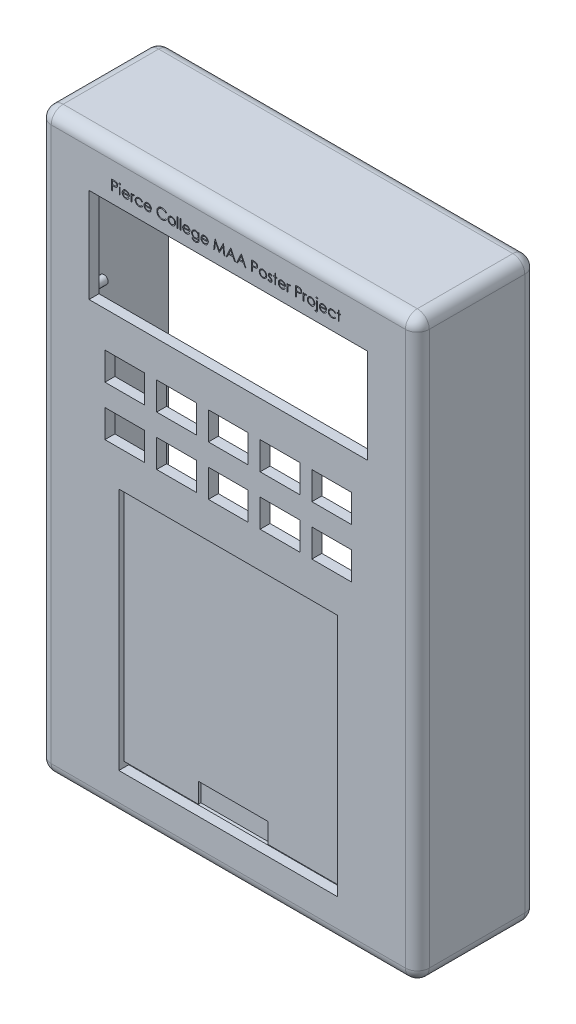
from build123d import *

# Parameters (mm, degrees)
SKETCH1_W           = 120.65
SKETCH1_H           = 184.15
BOSS_EXTRUDE1_DEPTH = 38.1
FILLET1_R           = 3.81
SKETCH2_W           = 88.9
SKETCH2_H           = 30.1625
CUT_EXTRUDE1_DEPTH  = 3.175
SKETCH3_W           = 114.3
SKETCH3_H           = 177.8
CUT_EXTRUDE2_DEPTH  = 34.925
SKETCH4_W           = 69.85
SKETCH4_H           = 77.7875
CUT_EXTRUDE3_DEPTH  = 1.5875
SKETCH5_W           = 69.85
SKETCH5_H           = 1.778
CUT_EXTRUDE4_DEPTH  = 3.175
SKETCH6_W           = 6.35
SKETCH6_H           = 6.35
BOSS_EXTRUDE2_DEPTH = 31.75
SKETCH7_R           = 1.322959
BOSS_EXTRUDE3_DEPTH = 4.7625
SKETCH8_W           = 22.225
SKETCH8_H           = 6.35
CUT_EXTRUDE5_DEPTH  = 0.79375
SKETCH9_R           = 1.905
CUT_EXTRUDE6_DEPTH  = 15.875
CUT_EXTRUDE8_START  = -3.175
SKETCH11_W          = 12.7
SKETCH11_H          = 8.89
CUT_EXTRUDE8_DEPTH  = 3.175
SKETCH14_W          = 0.284935897
SKETCH14_H          = 2.320192307
SKETCH14_H_2        = 3.256410256
SKETCH14_W_2        = 0.284935898
CUT_EXTRUDE10_DEPTH = 1.27


with BuildPart() as part:
    # Sketch1 → Boss-Extrude1 (new body)
    with BuildSketch(Plane.XY):
        with Locations((60.325, 92.075)):
            Rectangle(SKETCH1_W, SKETCH1_H)
    extrude(amount=BOSS_EXTRUDE1_DEPTH)

    # Fillet1
    fillet1_edges = [part.edges().sort_by_distance(p)[0] for p in [
        (120.65, 92.075, 38.1),
        (60.325, 184.15, 38.1),
        (0, 92.075, 38.1),
        (60.325, 184.15, 0),
        (120.65, 92.075, 0),
        (60.325, 0, 0),
        (0, 92.075, 0),
        (60.325, 0, 38.1),
        (0, 184.15, 19.05),
        (120.65, 184.15, 19.05),
        (120.65, 0, 19.05),
        (0, 0, 19.05),
    ]]
    fillet(fillet1_edges, radius=FILLET1_R)

    # Sketch2 → Cut-Extrude1 (cut)
    with BuildSketch(Plane.XY.offset(38.1)):
        with Locations((60.325, 153.19375)):
            Rectangle(SKETCH2_W, SKETCH2_H)
    extrude(amount=-CUT_EXTRUDE1_DEPTH, mode=Mode.SUBTRACT)

    # Sketch3 → Cut-Extrude2 (cut)
    with BuildSketch(Plane(origin=(0, 0, 0), x_dir=(-1, 0, 0), z_dir=(0, 0, -1))):
        with Locations((-60.325, 92.075)):
            Rectangle(SKETCH3_W, SKETCH3_H)
    extrude(amount=-CUT_EXTRUDE2_DEPTH, mode=Mode.SUBTRACT)

    # Sketch4 → Cut-Extrude3 (cut)
    with BuildSketch(Plane.XY.offset(38.1)):
        with Locations((60.325, 51.59375)):
            Rectangle(SKETCH4_W, SKETCH4_H)
    extrude(amount=-CUT_EXTRUDE3_DEPTH, mode=Mode.SUBTRACT)

    # Sketch5 → Cut-Extrude4 (cut)
    with BuildSketch(Plane.XY.offset(36.5125)):
        with Locations((60.325, 13.589)):
            Rectangle(SKETCH5_W, SKETCH5_H)
    extrude(amount=-CUT_EXTRUDE4_DEPTH, mode=Mode.SUBTRACT)

    # Sketch6 → Boss-Extrude2 (add)
    with BuildSketch(Plane(origin=(0, 0, 34.925), x_dir=(-1, 0, 0), z_dir=(0, 0, -1))):
        with Locations((-114.3, 177.8)):
            Rectangle(SKETCH6_W, SKETCH6_H)
        with Locations((-6.35, 177.8)):
            Rectangle(SKETCH6_W, SKETCH6_H)
        with Locations((-114.3, 6.35)):
            Rectangle(SKETCH6_W, SKETCH6_H)
        with Locations((-6.35, 6.35)):
            Rectangle(SKETCH6_W, SKETCH6_H)
    extrude(amount=BOSS_EXTRUDE2_DEPTH)

    # Sketch7 → Boss-Extrude3 (add)
    with BuildSketch(Plane(origin=(0, 0, 34.925), x_dir=(-1, 0, 0), z_dir=(0, 0, -1))):
        with Locations(Location((-107.95, 171.45, 0), (0, 0, 180))):
            Circle(SKETCH7_R)
        with Locations(Location((-12.7, 171.45, 0), (0, 0, 180))):
            Circle(SKETCH7_R)
        with Locations(Location((-12.7, 138.1125, 0), (0, 0, 180))):
            Circle(SKETCH7_R)
        with Locations(Location((-107.95, 138.1125, 0), (0, 0, 180))):
            Circle(SKETCH7_R)
    extrude(amount=BOSS_EXTRUDE3_DEPTH)

    # Sketch8 → Cut-Extrude5 (cut)
    with BuildSketch(Plane.XY.offset(36.5125)):
        with Locations((60.325, 17.653)):
            Rectangle(SKETCH8_W, SKETCH8_H)
    extrude(amount=-CUT_EXTRUDE5_DEPTH, mode=Mode.SUBTRACT)

    # Sketch9 → Cut-Extrude6 (cut)
    with BuildSketch(Plane(origin=(0, 0, 3.175), x_dir=(-1, 0, 0), z_dir=(0, 0, -1))):
        with Locations((-114.3, 177.8)):
            Circle(SKETCH9_R)
        with Locations((-6.35, 177.8)):
            Circle(SKETCH9_R)
        with Locations((-6.35, 6.35)):
            Circle(SKETCH9_R)
        with Locations((-114.3, 6.35)):
            Circle(SKETCH9_R)
    extrude(amount=-CUT_EXTRUDE6_DEPTH, mode=Mode.SUBTRACT)

    # Sketch11 → Cut-Extrude8 (cut)
    with BuildSketch(Plane.XY.offset(38.1).offset(CUT_EXTRUDE8_START)):
        with Locations((27.305, 122.2375)):
            Rectangle(SKETCH11_W, SKETCH11_H)
        with Locations((43.815, 122.2375)):
            Rectangle(SKETCH11_W, SKETCH11_H)
        with Locations((60.325, 122.2375)):
            Rectangle(SKETCH11_W, SKETCH11_H)
        with Locations((76.835, 122.2375)):
            Rectangle(SKETCH11_W, SKETCH11_H)
        with Locations((93.345, 122.2375)):
            Rectangle(SKETCH11_W, SKETCH11_H)
        with Locations((27.305, 106.3625)):
            Rectangle(SKETCH11_W, SKETCH11_H)
        with Locations((43.815, 106.3625)):
            Rectangle(SKETCH11_W, SKETCH11_H)
        with Locations((60.325, 106.3625)):
            Rectangle(SKETCH11_W, SKETCH11_H)
        with Locations((76.835, 106.3625)):
            Rectangle(SKETCH11_W, SKETCH11_H)
        with Locations((93.345, 106.3625)):
            Rectangle(SKETCH11_W, SKETCH11_H)
    extrude(amount=CUT_EXTRUDE8_DEPTH, mode=Mode.SUBTRACT)

    # Sketch14 → Cut-Extrude10 (cut)
    # profile 1 of 31: a face of its own
    with BuildSketch(Plane.XY.offset(38.1)):
        with BuildLine():
            Line((23.064077681, 175.027925221), (23.686738939, 175.027925221))
            add(Edge.make_bspline(
                [(23.686738939, 175.027925221), (23.729565976, 175.027878143), (23.811624479, 175.027787941), (23.929294565, 175.025053136), (24.036164822, 175.021400351), (24.13200481, 175.016336776), (24.217109414, 175.010352727), (24.291093535, 175.001959805), (24.354538704, 174.993196537), (24.39255384, 174.984287118), (24.409890983, 174.980223898)],
                knots=[0, 0, 0, 0, 1.415646017, 2.712440637, 3.8905458, 4.950247383, 5.884950622, 6.709939814, 7.411656543, 8, 8, 8, 8], degree=3))
            add(Edge.make_bspline(
                [(24.409890983, 174.980223898), (24.431837974, 174.974216844), (24.475214803, 174.962344284), (24.537717892, 174.938564692), (24.597184595, 174.910368728), (24.653818937, 174.878234154), (24.70692497, 174.840782249), (24.757295021, 174.799531181), (24.804484575, 174.753528544), (24.848228266, 174.703290302), (24.888400904, 174.649659826), (24.922989973, 174.591836517), (24.951952529, 174.530793692), (24.976793068, 174.466573809), (24.994671452, 174.398637587), (25.008139711, 174.32745707), (25.016688287, 174.253039886), (25.01750704, 174.202185578), (25.017923835, 174.176297616)],
                knots=[0, 0, 0, 0, 0.999701418, 1.975846123, 2.934577507, 3.890451536, 4.834027766, 5.787354733, 6.749476667, 7.726910423, 8.712836071, 9.690891519, 10.682875813, 11.679750201, 12.712814741, 13.765529915, 14.8625177, 16, 16, 16, 16], degree=3))
            add(Edge.make_bspline(
                [(25.017923835, 174.176297616), (25.017541543, 174.150192062), (25.016793562, 174.099114781), (25.007816217, 174.024390894), (24.995723829, 173.952982069), (24.977130074, 173.885046639), (24.952777214, 173.820988047), (24.924209423, 173.759827358), (24.889752935, 173.702605084), (24.850160839, 173.649113485), (24.806117607, 173.59930235), (24.757809585, 173.553532644), (24.705431798, 173.51207228), (24.649150706, 173.474828311), (24.588417629, 173.4426644), (24.524153676, 173.413855988), (24.455800265, 173.389661526), (24.408499556, 173.376934256), (24.384450277, 173.370463281)],
                knots=[0, 0, 0, 0, 1.121902311, 2.195077645, 3.232258892, 4.234102512, 5.217864754, 6.176164875, 7.132989551, 8.084763148, 9.034132444, 9.988522005, 10.94243251, 11.903244335, 12.886203696, 13.894208494, 14.929344452, 16, 16, 16, 16], degree=3))
            add(Edge.make_bspline(
                [(24.384450277, 173.370463281), (24.364559053, 173.366233291), (24.320966278, 173.356963023), (24.249172523, 173.346613922), (24.165583494, 173.337780527), (24.070313283, 173.331157353), (23.963447405, 173.325487376), (23.84492805, 173.320980605), (23.714522566, 173.318504237), (23.623562223, 173.318376518), (23.576071872, 173.318309836)],
                knots=[0, 0, 0, 0, 0.601384939, 1.31797006, 2.144135048, 3.087295005, 4.142315834, 5.309527816, 6.595305764, 8, 8, 8, 8], degree=3))
            Line((23.576071872, 173.318309836), (23.349013579, 173.318309836))
            Line((23.349013579, 173.318309836), (23.349013579, 171.852925221))
            Line((23.349013579, 171.852925221), (23.064077681, 171.852925221))
            Line((23.064077681, 171.852925221), (23.064077681, 175.027925221))
        make_face()
        with BuildLine():
            Line((23.349013579, 174.702284195), (23.349013579, 173.643950862))
            Line((23.349013579, 173.643950862), (23.904892986, 173.636954668))
            add(Edge.make_bspline(
                [(23.904892986, 173.636954668), (23.932034633, 173.63694064), (23.984431023, 173.63691356), (24.060119597, 173.640528727), (24.130340879, 173.644702067), (24.194879172, 173.650812512), (24.25376357, 173.659449653), (24.307092257, 173.668168872), (24.35445172, 173.680783023), (24.409877425, 173.697767521), (24.471638747, 173.726734965), (24.538828595, 173.768780937), (24.595770484, 173.822375579), (24.645044939, 173.882635112), (24.684148128, 173.949672179), (24.712773921, 174.021399001), (24.7295934, 174.097079978), (24.731848732, 174.148867076), (24.732987938, 174.175025581)],
                knots=[0, 0, 0, 0, 1.160613943, 2.240541288, 3.23993089, 4.169200891, 5.011653406, 5.7853311, 6.478053781, 7.106038997, 8.262395093, 9.384106736, 10.481365981, 11.59014053, 12.70357646, 13.786202915, 14.881775077, 16, 16, 16, 16], degree=3))
            add(Edge.make_bspline(
                [(24.732987938, 174.175025581), (24.731842537, 174.200551233), (24.729565622, 174.251293069), (24.712642089, 174.325659516), (24.684203783, 174.396630476), (24.644782444, 174.462827489), (24.596938704, 174.52287019), (24.541331443, 174.575028298), (24.478091556, 174.616957986), (24.419264946, 174.644021034), (24.367012442, 174.660544891), (24.321626307, 174.672106282), (24.270381195, 174.68133701), (24.213260424, 174.688811417), (24.150706724, 174.695209914), (24.082182681, 174.699551479), (24.007947876, 174.7020928), (23.956412573, 174.702218852), (23.929697673, 174.702284195)],
                knots=[0, 0, 0, 0, 1.120700087, 2.227813068, 3.331159281, 4.466773991, 5.599788987, 6.693661531, 7.80175334, 8.91857717, 9.525282508, 10.207424825, 10.974604443, 11.810962634, 12.737642355, 13.736264703, 14.826523623, 16, 16, 16, 16], degree=3))
            Line((23.929697673, 174.702284195), (23.349013579, 174.702284195))
        make_face(mode=Mode.SUBTRACT)
    # profile 2 of 31: a face of its own
    with BuildSketch(Plane.XY.offset(38.1)):
        with BuildLine():
            add(Edge.make_bspline(
                [(25.688286415, 175.150040605), (25.705967823, 175.14922041), (25.740591416, 175.14761431), (25.790659594, 175.133860684), (25.836249884, 175.110547398), (25.876688256, 175.079269402), (25.911388181, 175.042485264), (25.935682112, 174.999612814), (25.951296214, 174.953295334), (25.95318176, 174.920987361), (25.954141784, 174.904537801)],
                knots=[0, 0, 0, 0, 1.055194115, 2.066272739, 3.074728998, 4.095836921, 5.109056067, 6.073838105, 7.019297344, 8, 8, 8, 8], degree=3))
            add(Edge.make_bspline(
                [(25.954141784, 174.904537801), (25.95316011, 174.888515251), (25.951219458, 174.856840567), (25.935694172, 174.81132606), (25.911181142, 174.769049317), (25.876710507, 174.732336601), (25.836243988, 174.701075896), (25.790661161, 174.677758026), (25.740591004, 174.664005615), (25.705967684, 174.662399348), (25.688286415, 174.661579067)],
                knots=[0, 0, 0, 0, 0.96129708, 1.900370562, 2.859976407, 3.87933698, 4.906634145, 5.921202961, 6.938410037, 8, 8, 8, 8], degree=3))
            add(Edge.make_bspline(
                [(25.688286415, 174.661579067), (25.670807337, 174.662368027), (25.636786595, 174.663903636), (25.587468102, 174.678027866), (25.542266544, 174.701083875), (25.501749305, 174.732131915), (25.467976202, 174.769274786), (25.443394149, 174.811300259), (25.42790472, 174.856847135), (25.425959235, 174.888517458), (25.424975117, 174.904537801)],
                knots=[0, 0, 0, 0, 1.054934014, 2.053291228, 3.073705704, 4.106921865, 5.123545215, 6.088680038, 7.033164197, 8, 8, 8, 8], degree=3))
            add(Edge.make_bspline(
                [(25.424975117, 174.904537801), (25.425937674, 174.920985071), (25.427828197, 174.953288549), (25.44340576, 174.999639043), (25.467771443, 175.042257977), (25.501771668, 175.079473966), (25.542260593, 175.110539467), (25.58746964, 175.133590857), (25.636786189, 175.147716287), (25.670807199, 175.14925173), (25.688286415, 175.150040605)],
                knots=[0, 0, 0, 0, 0.98631895, 1.937192651, 2.907499808, 3.917963147, 4.944918757, 5.95915025, 6.951458133, 8, 8, 8, 8], degree=3))
        make_face()
    # profile 3 of 31: a face of its own
    with BuildSketch(Plane.XY.offset(38.1)):
        with Locations((25.689558451, 173.013021374)):
            Rectangle(SKETCH14_W, SKETCH14_H)
    # profile 4 of 31: a face of its own
    with BuildSketch(Plane.XY.offset(38.1)):
        with BuildLine():
            Line((28.428250358, 172.585617528), (28.681385374, 172.452689844))
            add(Edge.make_bspline(
                [(28.681385374, 172.452689844), (28.661213605, 172.416909108), (28.621967332, 172.347293964), (28.554475225, 172.251652205), (28.483725273, 172.165611777), (28.406523816, 172.091471305), (28.325180608, 172.02683612), (28.239244556, 171.970286808), (28.148268272, 171.922100722), (28.05224745, 171.881503786), (27.950375714, 171.850289459), (27.842406196, 171.828242058), (27.728132054, 171.814613808), (27.649803733, 171.813030716), (27.60969567, 171.812220092)],
                knots=[0, 0, 0, 0, 1.120438281, 2.179929193, 3.190490725, 4.156257408, 5.095198341, 6.022838206, 6.959905092, 7.901321166, 8.864066838, 9.862729781, 10.905609505, 12, 12, 12, 12], degree=3))
            add(Edge.make_bspline(
                [(27.60969567, 171.812220092), (27.565116876, 171.813260744), (27.478156564, 171.815290755), (27.351574079, 171.832791776), (27.232394178, 171.861341701), (27.120623561, 171.901224728), (27.016535946, 171.953319515), (26.919924457, 172.016782759), (26.83028103, 172.091288448), (26.750430497, 172.177481936), (26.678544975, 172.269721997), (26.615112267, 172.365839121), (26.562083026, 172.465591474), (26.518946015, 172.568344021), (26.484107316, 172.673449124), (26.459826092, 172.781863099), (26.445829106, 172.893292521), (26.443684216, 172.968673676), (26.442603322, 173.006661198)],
                knots=[0, 0, 0, 0, 1.145258523, 2.234067595, 3.276747158, 4.290159414, 5.277019952, 6.260822364, 7.254936242, 8.264827045, 9.274100331, 10.257902744, 11.220704747, 12.172965371, 13.118907548, 14.062713208, 15.023725156, 16, 16, 16, 16], degree=3))
            add(Edge.make_bspline(
                [(26.442603322, 173.006661198), (26.443564115, 173.042307223), (26.445468279, 173.112952937), (26.457470493, 173.217515252), (26.478741444, 173.319141062), (26.507929967, 173.417914812), (26.545622883, 173.513671119), (26.591734968, 173.606468262), (26.646338053, 173.696207496), (26.688495407, 173.752816053), (26.709730726, 173.781330669)],
                knots=[0, 0, 0, 0, 1.024358464, 2.0301432, 3.019427413, 4.004406732, 4.986367066, 5.972626655, 6.978780325, 8, 8, 8, 8], degree=3))
            add(Edge.make_bspline(
                [(26.709730726, 173.781330669), (26.738494124, 173.815683144), (26.795109768, 173.883299895), (26.890864462, 173.972143948), (26.994551069, 174.046569372), (27.104870187, 174.10826156), (27.223103988, 174.15513694), (27.347663131, 174.190068818), (27.479965913, 174.209643157), (27.570412792, 174.212407977), (27.616691864, 174.213822656)],
                knots=[0, 0, 0, 0, 1.030682036, 2.02871468, 2.997146059, 3.962720338, 4.930598197, 5.918074684, 6.934738563, 8, 8, 8, 8], degree=3))
            add(Edge.make_bspline(
                [(27.616691864, 174.213822656), (27.664269334, 174.212594341), (27.757605486, 174.210184665), (27.893706053, 174.187845063), (28.022484703, 174.152418817), (28.143889903, 174.10238645), (28.257933963, 174.037834571), (28.363875594, 173.957877329), (28.463526608, 173.864969492), (28.521500819, 173.79352001), (28.55100176, 173.757161999)],
                knots=[0, 0, 0, 0, 1.056321875, 2.072262726, 3.055038591, 4.01806755, 4.982017516, 5.957941055, 6.960871419, 8, 8, 8, 8], degree=3))
            add(Edge.make_bspline(
                [(28.55100176, 173.757161999), (28.571074054, 173.729763036), (28.611085035, 173.675147486), (28.661202047, 173.586092222), (28.704706255, 173.49291904), (28.739479727, 173.394121842), (28.767636989, 173.290871223), (28.788008531, 173.182429057), (28.799955257, 173.068827637), (28.802303575, 172.991424262), (28.803500758, 172.951963682)],
                knots=[0, 0, 0, 0, 0.94817472, 1.890038105, 2.849395472, 3.817997239, 4.812318967, 5.836947057, 6.897266129, 8, 8, 8, 8], degree=3))
            Line((28.803500758, 172.951963682), (26.72753922, 172.951963682))
            add(Edge.make_bspline(
                [(26.72753922, 172.951963682), (26.728935863, 172.921392547), (26.731682305, 172.861275642), (26.744486756, 172.773309289), (26.764669572, 172.689513471), (26.793035079, 172.610516712), (26.827385717, 172.535287239), (26.869464189, 172.464383105), (26.91966507, 172.398127269), (26.975659097, 172.33592708), (27.037986248, 172.280536246), (27.103557026, 172.230959278), (27.173310474, 172.189407058), (27.246696593, 172.155679586), (27.323596712, 172.129276), (27.404035061, 172.111253048), (27.487853352, 172.099181601), (27.544990411, 172.097839333), (27.574078683, 172.09715599)],
                knots=[0, 0, 0, 0, 1.094153842, 2.151609401, 3.174256925, 4.172055639, 5.149267565, 6.128595816, 7.11444997, 8.118368179, 9.117203808, 10.09244225, 11.054858984, 12.015122123, 12.976791628, 13.957293641, 14.960065497, 16, 16, 16, 16], degree=3))
            add(Edge.make_bspline(
                [(27.574078683, 172.09715599), (27.602518652, 172.097707584), (27.658949008, 172.098802053), (27.7429875, 172.109444572), (27.825664071, 172.126653322), (27.906636534, 172.150139242), (27.984261516, 172.178783958), (28.056148551, 172.213348693), (28.122261318, 172.251584534), (28.184053138, 172.295317597), (28.243988967, 172.348846452), (28.303445366, 172.41564457), (28.36719633, 172.494645399), (28.407101175, 172.554104682), (28.428250358, 172.585617528)],
                knots=[0, 0, 0, 0, 0.99110716, 1.966546729, 2.947904876, 3.932708344, 4.903319531, 5.828989031, 6.710028674, 7.56322171, 8.463672341, 9.504779593, 10.677557249, 12, 12, 12, 12], degree=3))
        make_face()
        with BuildLine():
            add(Edge.make_bspline(
                [(28.518564861, 173.23689958), (28.50813578, 173.274693758), (28.488063156, 173.347435385), (28.446120169, 173.448165336), (28.398883842, 173.53768936), (28.342984129, 173.615322313), (28.279648571, 173.684268357), (28.206491869, 173.744519502), (28.124453595, 173.798419618), (28.033957803, 173.8439151), (27.938125612, 173.8826409), (27.837789995, 173.90860797), (27.735411859, 173.926396626), (27.666165756, 173.928053167), (27.631320269, 173.928886759)],
                knots=[0, 0, 0, 0, 1.154881502, 2.222775134, 3.210006277, 4.132804581, 5.035138423, 5.962687519, 6.919655026, 7.923214229, 8.944639381, 9.960483929, 10.97369054, 12, 12, 12, 12], degree=3))
            add(Edge.make_bspline(
                [(27.631320269, 173.928886759), (27.60288185, 173.928331886), (27.546665074, 173.927235017), (27.463841962, 173.916829971), (27.38430395, 173.899630684), (27.307464153, 173.876076759), (27.234329508, 173.844681812), (27.163395683, 173.807867028), (27.096466323, 173.762925734), (27.054609577, 173.728673059), (27.033463699, 173.71136873)],
                knots=[0, 0, 0, 0, 1.04873581, 2.073130211, 3.073294108, 4.04793562, 5.032784715, 6.005352987, 6.992311501, 8, 8, 8, 8], degree=3))
            add(Edge.make_bspline(
                [(27.033463699, 173.71136873), (27.018320507, 173.69767603), (26.987674378, 173.669965341), (26.946725477, 173.622223132), (26.907518334, 173.570741358), (26.871837092, 173.513550423), (26.839109567, 173.451301574), (26.808484445, 173.384519862), (26.780919628, 173.312698522), (26.765411014, 173.262649238), (26.757432048, 173.23689958)],
                knots=[0, 0, 0, 0, 0.879870761, 1.780643979, 2.707998968, 3.669668524, 4.684282772, 5.740141944, 6.837334558, 8, 8, 8, 8], degree=3))
            Line((26.757432048, 173.23689958), (28.518564861, 173.23689958))
        make_face(mode=Mode.SUBTRACT)
    # profile 5 of 31: a face of its own
    with BuildSketch(Plane.XY.offset(38.1)):
        with BuildLine():
            Line((29.291962297, 174.173117528), (29.576898194, 174.173117528))
            Line((29.576898194, 174.173117528), (29.576898194, 173.831576062))
            add(Edge.make_bspline(
                [(29.576898194, 173.831576062), (29.597933711, 173.863376706), (29.638163973, 173.924195191), (29.705032131, 174.004630914), (29.773524439, 174.071228849), (29.843968787, 174.124299899), (29.916883206, 174.164044656), (29.990667441, 174.193157624), (30.066482331, 174.21037276), (30.11742922, 174.21267115), (30.142953883, 174.213822656)],
                knots=[0, 0, 0, 0, 1.2804753, 2.448899062, 3.506932113, 4.484331642, 5.4025378, 6.288909075, 7.142734305, 8, 8, 8, 8], degree=3))
            add(Edge.make_bspline(
                [(30.142953883, 174.213822656), (30.162753479, 174.212742679), (30.203492435, 174.210520554), (30.265162356, 174.194907878), (30.328701773, 174.169981386), (30.369652367, 174.146540613), (30.391000758, 174.134320453)],
                knots=[0, 0, 0, 0, 0.901110191, 1.854092781, 2.881294221, 4, 4, 4, 4], degree=3))
            Line((30.391000758, 174.134320453), (30.234540422, 173.887545613))
            add(Edge.make_bspline(
                [(30.234540422, 173.887545613), (30.220834381, 173.893659997), (30.194817692, 173.905266269), (30.156758907, 173.919002236), (30.121669409, 173.927090245), (30.099314181, 173.928315539), (30.088892385, 173.928886759)],
                knots=[0, 0, 0, 0, 1.180555205, 2.24091978, 3.179933427, 4, 4, 4, 4], degree=3))
            add(Edge.make_bspline(
                [(30.088892385, 173.928886759), (30.066027184, 173.927362725), (30.019388801, 173.924254138), (29.950913577, 173.899816791), (29.884467898, 173.86033318), (29.83169789, 173.816544386), (29.790838132, 173.774318884), (29.761682356, 173.737444976), (29.734937292, 173.696098646), (29.709382878, 173.650986718), (29.686099883, 173.601338929), (29.664369576, 173.5476513), (29.644721893, 173.489861647), (29.633518457, 173.449600361), (29.627779604, 173.428976903)],
                knots=[0, 0, 0, 0, 1.125678352, 2.296057538, 3.5422874, 4.923748041, 5.663163013, 6.437101912, 7.23742474, 8.08941207, 8.991984279, 9.93940061, 10.944477711, 12, 12, 12, 12], degree=3))
            add(Edge.make_bspline(
                [(29.627779604, 173.428976903), (29.623486647, 173.41058261), (29.613978074, 173.369840648), (29.604732894, 173.301488772), (29.595598402, 173.220731596), (29.589160756, 173.12734433), (29.583193532, 173.021560184), (29.579827957, 172.903218005), (29.577012965, 172.772196322), (29.576937612, 172.680598159), (29.576898194, 172.632682833)],
                knots=[0, 0, 0, 0, 0.566838948, 1.255505196, 2.06880316, 3.007127437, 4.065329342, 5.249902469, 6.561414163, 8, 8, 8, 8], degree=3))
            Line((29.576898194, 172.632682833), (29.576898194, 171.852925221))
            Line((29.576898194, 171.852925221), (29.291962297, 171.852925221))
            Line((29.291962297, 171.852925221), (29.291962297, 174.173117528))
        make_face()
    # profile 6 of 31: a face of its own
    with BuildSketch(Plane.XY.offset(38.1)):
        with BuildLine():
            Line((32.955423835, 173.670027584), (32.716917225, 173.521835477))
            add(Edge.make_bspline(
                [(32.716917225, 173.521835477), (32.690764418, 173.554336949), (32.639287059, 173.618310577), (32.549897894, 173.700869588), (32.45463754, 173.771778262), (32.351878168, 173.829566664), (32.241763907, 173.874217551), (32.124729006, 173.905813524), (32.000790155, 173.925502372), (31.915822439, 173.927740146), (31.872285814, 173.928886759)],
                knots=[0, 0, 0, 0, 1.026593902, 2.0206758, 2.988051866, 3.946915611, 4.916868779, 5.907761954, 6.927957743, 8, 8, 8, 8], degree=3))
            add(Edge.make_bspline(
                [(31.872285814, 173.928886759), (31.83748876, 173.927928052), (31.768956909, 173.926039905), (31.668349184, 173.914237529), (31.572516478, 173.89279085), (31.480858121, 173.864532482), (31.394026027, 173.826659005), (31.311792694, 173.780567298), (31.233428714, 173.727000475), (31.161204955, 173.664942338), (31.095138642, 173.597452118), (31.037898913, 173.525104123), (30.988063266, 173.450065364), (30.948960006, 173.370461998), (30.916960387, 173.28811515), (30.895908576, 173.201470438), (30.881879888, 173.111637888), (30.880274855, 173.050389108), (30.879462297, 173.019381551)],
                knots=[0, 0, 0, 0, 1.112346261, 2.190735716, 3.231507886, 4.247384806, 5.251966152, 6.253067467, 7.256802811, 8.280671706, 9.291813951, 10.270744147, 11.225547591, 12.165006084, 13.100104208, 14.043489273, 15.009504848, 16, 16, 16, 16], degree=3))
            add(Edge.make_bspline(
                [(30.879462297, 173.019381551), (30.881076333, 172.978769481), (30.884282657, 172.898092553), (30.909411838, 172.779004561), (30.950545693, 172.663866642), (31.006841029, 172.55349626), (31.078031001, 172.451357276), (31.161644684, 172.359750857), (31.257728423, 172.280452031), (31.365435609, 172.214709098), (31.482237276, 172.161857715), (31.606869729, 172.124204634), (31.738314529, 172.101478553), (31.828309221, 172.098615662), (31.874193867, 172.09715599)],
                knots=[0, 0, 0, 0, 0.966302908, 1.919585723, 2.883856336, 3.870342332, 4.860282998, 5.839159637, 6.814385684, 7.815993281, 8.834850808, 9.858348828, 10.908058873, 12, 12, 12, 12], degree=3))
            add(Edge.make_bspline(
                [(31.874193867, 172.09715599), (31.916244642, 172.098334819), (31.998885572, 172.100651532), (32.119687324, 172.120181378), (32.234694814, 172.152152388), (32.343903956, 172.196736328), (32.447115192, 172.25436486), (32.543661658, 172.325447822), (32.635464459, 172.40794031), (32.689436717, 172.471728755), (32.716917225, 172.504207272)],
                knots=[0, 0, 0, 0, 1.039848629, 2.043578496, 3.018386758, 3.987534228, 4.954977003, 5.934852016, 6.948509513, 8, 8, 8, 8], degree=3))
            Line((32.716917225, 172.504207272), (32.955423835, 172.347746935))
            add(Edge.make_bspline(
                [(32.955423835, 172.347746935), (32.941283562, 172.326981776), (32.91304995, 172.285520379), (32.865853461, 172.227060359), (32.814944757, 172.172339976), (32.760522448, 172.121432579), (32.703297146, 172.073119947), (32.641313971, 172.029711733), (32.576571538, 171.988768001), (32.508309802, 171.951926324), (32.437234526, 171.918809876), (32.363445721, 171.890333599), (32.287264033, 171.86586786), (32.208599892, 171.846421124), (32.127298213, 171.830899149), (32.043569259, 171.82059972), (31.957441867, 171.812911429), (31.899228558, 171.812452536), (31.869741744, 171.812220092)],
                knots=[0, 0, 0, 0, 0.954134338, 1.905101784, 2.851144739, 3.791306361, 4.734911809, 5.6936923, 6.663572882, 7.643865596, 8.638447847, 9.640600242, 10.646758161, 11.676244097, 12.717260333, 13.78922464, 14.880174919, 16, 16, 16, 16], degree=3))
            add(Edge.make_bspline(
                [(31.869741744, 171.812220092), (31.824737585, 171.81302861), (31.736529107, 171.814613312), (31.607422261, 171.832038143), (31.484038434, 171.858306838), (31.366419781, 171.896011082), (31.25454799, 171.944547557), (31.148527375, 172.003835615), (31.048708988, 172.074367596), (30.95607992, 172.154888108), (30.871006751, 172.242192118), (30.797957993, 172.336398829), (30.734598355, 172.434044637), (30.683718941, 172.537286136), (30.6432178, 172.644751152), (30.615545559, 172.757300584), (30.597647868, 172.874006558), (30.595576517, 172.953592815), (30.594526399, 172.993940846)],
                knots=[0, 0, 0, 0, 1.1129367, 2.181364009, 3.217532258, 4.231199276, 5.232079859, 6.230262199, 7.231623845, 8.250719726, 9.263571943, 10.242672461, 11.195837495, 12.138959767, 13.085126421, 14.0317438, 15.002148558, 16, 16, 16, 16], degree=3))
            add(Edge.make_bspline(
                [(30.594526399, 172.993940846), (30.594926464, 173.021316997), (30.595722258, 173.07577268), (30.604849864, 173.156594634), (30.616641336, 173.236340243), (30.636621826, 173.313998674), (30.659700114, 173.390747758), (30.68916006, 173.465662429), (30.723718026, 173.539090811), (30.762953721, 173.610843751), (30.807121368, 173.679740833), (30.855999344, 173.744831658), (30.907746706, 173.806898159), (30.964784322, 173.863797571), (31.024691722, 173.917805401), (31.089163794, 173.967478843), (31.157830746, 174.012963885), (31.229661331, 174.055101591), (31.304613748, 174.092620508), (31.382234942, 174.124944945), (31.46205719, 174.152569781), (31.544208178, 174.174440015), (31.628142635, 174.192780107), (31.714521991, 174.20431701), (31.803015793, 174.212468843), (31.862938042, 174.213367633), (31.893274396, 174.213822656)],
                knots=[0, 0, 0, 0, 0.990994727, 1.971252077, 2.943264845, 3.907940874, 4.872158414, 5.844625996, 6.82015047, 7.809835459, 8.804511986, 9.781214284, 10.756496977, 11.728388426, 12.696359165, 13.676225489, 14.672885716, 15.677705647, 16.690706858, 17.706033469, 18.721040654, 19.747369689, 20.783475414, 21.830280724, 22.901553713, 24, 24, 24, 24], degree=3))
            add(Edge.make_bspline(
                [(31.893274396, 174.213822656), (31.931265637, 174.21298637), (32.007058221, 174.211317976), (32.119490147, 174.197276627), (32.230266073, 174.176107164), (32.337442374, 174.144744668), (32.439719569, 174.106768352), (32.535455299, 174.064121104), (32.622395965, 174.014595999), (32.702158849, 173.960421324), (32.774893126, 173.89931536), (32.841345415, 173.83054762), (32.902878412, 173.754475999), (32.937764143, 173.698409372), (32.955423835, 173.670027584)],
                knots=[0, 0, 0, 0, 1.095225653, 2.184976855, 3.262915854, 4.344593502, 5.400796181, 6.407717688, 7.363229445, 8.282371371, 9.184954523, 10.097238608, 11.036792983, 12, 12, 12, 12], degree=3))
        make_face()
    # profile 7 of 31: a face of its own
    with BuildSketch(Plane.XY.offset(38.1)):
        with BuildLine():
            Line((35.429532409, 172.585617528), (35.682667425, 172.452689844))
            add(Edge.make_bspline(
                [(35.682667425, 172.452689844), (35.662495656, 172.416909108), (35.623249383, 172.347293964), (35.555757276, 172.251652205), (35.485007324, 172.165611777), (35.407805868, 172.091471305), (35.326462659, 172.02683612), (35.240526608, 171.970286808), (35.149550323, 171.922100722), (35.053529501, 171.881503786), (34.951657766, 171.850289459), (34.843688247, 171.828242058), (34.729414105, 171.814613808), (34.651085785, 171.813030716), (34.610977721, 171.812220092)],
                knots=[0, 0, 0, 0, 1.120438281, 2.179929193, 3.190490725, 4.156257408, 5.095198341, 6.022838206, 6.959905092, 7.901321166, 8.864066838, 9.862729781, 10.905609505, 12, 12, 12, 12], degree=3))
            add(Edge.make_bspline(
                [(34.610977721, 171.812220092), (34.566398927, 171.813260744), (34.479438615, 171.815290755), (34.35285613, 171.832791776), (34.233676229, 171.861341701), (34.121905613, 171.901224728), (34.017817998, 171.953319515), (33.921206508, 172.016782759), (33.831563081, 172.091288448), (33.751712548, 172.177481936), (33.679827026, 172.269721997), (33.616394318, 172.365839121), (33.563365077, 172.465591474), (33.520228066, 172.568344021), (33.485389367, 172.673449124), (33.461108143, 172.781863099), (33.447111158, 172.893292521), (33.444966268, 172.968673676), (33.443885374, 173.006661198)],
                knots=[0, 0, 0, 0, 1.145258523, 2.234067595, 3.276747158, 4.290159414, 5.277019952, 6.260822364, 7.254936242, 8.264827045, 9.274100331, 10.257902744, 11.220704747, 12.172965371, 13.118907548, 14.062713208, 15.023725156, 16, 16, 16, 16], degree=3))
            add(Edge.make_bspline(
                [(33.443885374, 173.006661198), (33.444846166, 173.042307223), (33.44675033, 173.112952937), (33.458752544, 173.217515252), (33.480023496, 173.319141062), (33.509212018, 173.417914812), (33.546904934, 173.513671119), (33.593017019, 173.606468262), (33.647620104, 173.696207496), (33.689777459, 173.752816053), (33.711012777, 173.781330669)],
                knots=[0, 0, 0, 0, 1.024358464, 2.0301432, 3.019427413, 4.004406732, 4.986367066, 5.972626655, 6.978780325, 8, 8, 8, 8], degree=3))
            add(Edge.make_bspline(
                [(33.711012777, 173.781330669), (33.739776175, 173.815683144), (33.79639182, 173.883299895), (33.892146514, 173.972143948), (33.99583312, 174.046569372), (34.106152238, 174.10826156), (34.22438604, 174.15513694), (34.348945182, 174.190068818), (34.481247964, 174.209643157), (34.571694843, 174.212407977), (34.617973915, 174.213822656)],
                knots=[0, 0, 0, 0, 1.030682036, 2.02871468, 2.997146059, 3.962720338, 4.930598197, 5.918074684, 6.934738563, 8, 8, 8, 8], degree=3))
            add(Edge.make_bspline(
                [(34.617973915, 174.213822656), (34.665551386, 174.212594341), (34.758887537, 174.210184665), (34.894988104, 174.187845063), (35.023766754, 174.152418817), (35.145171955, 174.10238645), (35.259216014, 174.037834571), (35.365157645, 173.957877329), (35.46480866, 173.864969492), (35.522782871, 173.79352001), (35.552283811, 173.757161999)],
                knots=[0, 0, 0, 0, 1.056321875, 2.072262726, 3.055038591, 4.01806755, 4.982017516, 5.957941055, 6.960871419, 8, 8, 8, 8], degree=3))
            add(Edge.make_bspline(
                [(35.552283811, 173.757161999), (35.572356105, 173.729763036), (35.612367086, 173.675147486), (35.662484098, 173.586092222), (35.705988306, 173.49291904), (35.740761778, 173.394121842), (35.76891904, 173.290871223), (35.789290583, 173.182429057), (35.801237308, 173.068827637), (35.803585626, 172.991424262), (35.804782809, 172.951963682)],
                knots=[0, 0, 0, 0, 0.94817472, 1.890038105, 2.849395472, 3.817997239, 4.812318967, 5.836947057, 6.897266129, 8, 8, 8, 8], degree=3))
            Line((35.804782809, 172.951963682), (33.728821271, 172.951963682))
            add(Edge.make_bspline(
                [(33.728821271, 172.951963682), (33.730217914, 172.921392547), (33.732964356, 172.861275642), (33.745768807, 172.773309289), (33.765951624, 172.689513471), (33.79431713, 172.610516712), (33.828667769, 172.535287239), (33.87074624, 172.464383105), (33.920947121, 172.398127269), (33.976941149, 172.33592708), (34.039268299, 172.280536246), (34.104839077, 172.230959278), (34.174592525, 172.189407058), (34.247978644, 172.155679586), (34.324878763, 172.129276), (34.405317112, 172.111253048), (34.489135403, 172.099181601), (34.546272462, 172.097839333), (34.575360734, 172.09715599)],
                knots=[0, 0, 0, 0, 1.094153842, 2.151609401, 3.174256925, 4.172055639, 5.149267565, 6.128595816, 7.11444997, 8.118368179, 9.117203808, 10.09244225, 11.054858984, 12.015122123, 12.976791628, 13.957293641, 14.960065497, 16, 16, 16, 16], degree=3))
            add(Edge.make_bspline(
                [(34.575360734, 172.09715599), (34.603800704, 172.097707584), (34.660231059, 172.098802053), (34.744269551, 172.109444572), (34.826946122, 172.126653322), (34.907918586, 172.150139242), (34.985543567, 172.178783958), (35.057430602, 172.213348693), (35.123543369, 172.251584534), (35.185335189, 172.295317597), (35.245271019, 172.348846452), (35.304727417, 172.41564457), (35.368478381, 172.494645399), (35.408383226, 172.554104682), (35.429532409, 172.585617528)],
                knots=[0, 0, 0, 0, 0.99110716, 1.966546729, 2.947904876, 3.932708344, 4.903319531, 5.828989031, 6.710028674, 7.56322171, 8.463672341, 9.504779593, 10.677557249, 12, 12, 12, 12], degree=3))
        make_face()
        with BuildLine():
            add(Edge.make_bspline(
                [(35.519846912, 173.23689958), (35.509417831, 173.274693758), (35.489345208, 173.347435385), (35.44740222, 173.448165336), (35.400165894, 173.53768936), (35.34426618, 173.615322313), (35.280930622, 173.684268357), (35.207773921, 173.744519502), (35.125735646, 173.798419618), (35.035239854, 173.8439151), (34.939407663, 173.8826409), (34.839072046, 173.90860797), (34.73669391, 173.926396626), (34.667447807, 173.928053167), (34.632602321, 173.928886759)],
                knots=[0, 0, 0, 0, 1.154881502, 2.222775134, 3.210006277, 4.132804581, 5.035138423, 5.962687519, 6.919655026, 7.923214229, 8.944639381, 9.960483929, 10.97369054, 12, 12, 12, 12], degree=3))
            add(Edge.make_bspline(
                [(34.632602321, 173.928886759), (34.604163901, 173.928331886), (34.547947126, 173.927235017), (34.465124014, 173.916829971), (34.385586001, 173.899630684), (34.308746204, 173.876076759), (34.23561156, 173.844681812), (34.164677734, 173.807867028), (34.097748375, 173.762925734), (34.055891628, 173.728673059), (34.03474575, 173.71136873)],
                knots=[0, 0, 0, 0, 1.04873581, 2.073130211, 3.073294108, 4.04793562, 5.032784715, 6.005352987, 6.992311501, 8, 8, 8, 8], degree=3))
            add(Edge.make_bspline(
                [(34.03474575, 173.71136873), (34.019602559, 173.69767603), (33.98895643, 173.669965341), (33.948007528, 173.622223132), (33.908800385, 173.570741358), (33.873119143, 173.513550423), (33.840391618, 173.451301574), (33.809766496, 173.384519862), (33.782201679, 173.312698522), (33.766693065, 173.262649238), (33.7587141, 173.23689958)],
                knots=[0, 0, 0, 0, 0.879870761, 1.780643979, 2.707998968, 3.669668524, 4.684282772, 5.740141944, 6.837334558, 8, 8, 8, 8], degree=3))
            Line((33.7587141, 173.23689958), (35.519846912, 173.23689958))
        make_face(mode=Mode.SUBTRACT)
    # profile 8 of 31: a face of its own
    with BuildSketch(Plane.XY.offset(38.1)):
        with BuildLine():
            Line((40.607987938, 174.445333073), (40.358669027, 174.254527785))
            add(Edge.make_bspline(
                [(40.358669027, 174.254527785), (40.340883686, 174.275724057), (40.305552788, 174.317830831), (40.24871194, 174.376957989), (40.189474021, 174.432352905), (40.127861675, 174.484279467), (40.062765902, 174.530921819), (39.995763606, 174.574710605), (39.925733951, 174.613960624), (39.828894878, 174.661552048), (39.702214329, 174.711214631), (39.542743297, 174.752855419), (39.376272515, 174.7793632), (39.262700406, 174.782234164), (39.20493305, 174.783694451)],
                knots=[0, 0, 0, 0, 0.757959112, 1.505699292, 2.245454638, 2.979532153, 3.711538275, 4.438200793, 5.171680507, 5.909471876, 7.393775596, 8.890124382, 10.418191784, 12, 12, 12, 12], degree=3))
            add(Edge.make_bspline(
                [(39.20493305, 174.783694451), (39.173107485, 174.783328), (39.109751728, 174.782598497), (39.015727755, 174.772974505), (38.923459488, 174.759447907), (38.833006943, 174.739377078), (38.74448526, 174.714001917), (38.657315723, 174.683680291), (38.572760394, 174.646165544), (38.489649563, 174.604701622), (38.410021279, 174.557868155), (38.334678486, 174.5067839), (38.263895972, 174.452020505), (38.197617745, 174.393372716), (38.135776049, 174.331104652), (38.078818989, 174.264552713), (38.026943652, 174.19392967), (37.979121779, 174.120166793), (37.936293086, 174.043478939), (37.900433838, 173.963582268), (37.868679191, 173.881844975), (37.843552021, 173.797343565), (37.823663352, 173.710672627), (37.809940401, 173.621599555), (37.800425859, 173.530310431), (37.799699984, 173.468434841), (37.799334092, 173.437245132)],
                knots=[0, 0, 0, 0, 1.054917814, 2.100044995, 3.131103042, 4.146048494, 5.169673617, 6.183595914, 7.203665975, 8.234915748, 9.262203917, 10.264457458, 11.251630812, 12.227803204, 13.197192746, 14.159520551, 15.12972552, 16.100847026, 17.073214652, 18.039054194, 19.002613845, 19.979014051, 20.95965708, 21.949030935, 22.966165397, 24, 24, 24, 24], degree=3))
            add(Edge.make_bspline(
                [(37.799334092, 173.437245132), (37.800478742, 173.390317435), (37.80272611, 173.298181126), (37.822727099, 173.163224929), (37.853121003, 173.033938318), (37.898673705, 172.911129461), (37.95484313, 172.793284022), (38.025818542, 172.682395919), (38.108020686, 172.576789464), (38.202612481, 172.478960505), (38.3063949, 172.389594482), (38.417744791, 172.310899312), (38.536384823, 172.245299383), (38.661005052, 172.190711203), (38.792564456, 172.148749743), (38.930826455, 172.119209431), (39.075490336, 172.099939738), (39.174341149, 172.098094893), (39.224649596, 172.09715599)],
                knots=[0, 0, 0, 0, 1.029171465, 2.020641659, 2.987623507, 3.938342917, 4.889210282, 5.84687017, 6.821220943, 7.821438502, 8.827599549, 9.822697543, 10.807740252, 11.797342354, 12.80366471, 13.83203677, 14.896651826, 16, 16, 16, 16], degree=3))
            add(Edge.make_bspline(
                [(39.224649596, 172.09715599), (39.280078464, 172.098687954), (39.389175736, 172.101703227), (39.549166731, 172.127247689), (39.70232489, 172.168665943), (39.848658451, 172.226630486), (39.98775488, 172.301982569), (40.11983185, 172.393329929), (40.245000846, 172.501541488), (40.320267652, 172.584166897), (40.358669027, 172.626322656)],
                knots=[0, 0, 0, 0, 1.028121516, 2.023589091, 2.998037872, 3.967518031, 4.937445131, 5.927275754, 6.942489185, 8, 8, 8, 8], degree=3))
            Line((40.358669027, 172.626322656), (40.607987938, 172.437425421))
            add(Edge.make_bspline(
                [(40.607987938, 172.437425421), (40.587923652, 172.411536968), (40.547891188, 172.359884067), (40.483068559, 172.287066159), (40.414781296, 172.218573212), (40.342522188, 172.154957441), (40.267122477, 172.09494589), (40.187228308, 172.040243515), (40.103889971, 171.990086784), (40.017389837, 171.944160931), (39.927819809, 171.903414571), (39.835287215, 171.868531511), (39.740190907, 171.838482504), (39.642526539, 171.813761104), (39.542091531, 171.794465192), (39.439248315, 171.781565916), (39.333774928, 171.772728608), (39.262617353, 171.771923141), (39.226557649, 171.771514964)],
                knots=[0, 0, 0, 0, 0.986787822, 1.968848986, 2.935600012, 3.899624008, 4.868462664, 5.837806735, 6.815139263, 7.798259679, 8.787526145, 9.778297419, 10.776456485, 11.791383307, 12.812564526, 13.85620153, 14.913611965, 16, 16, 16, 16], degree=3))
            add(Edge.make_bspline(
                [(39.226557649, 171.771514964), (39.192409466, 171.771752629), (39.124885661, 171.772222581), (39.025191793, 171.779835476), (38.928136959, 171.790222023), (38.833998549, 171.805861285), (38.742262843, 171.824316508), (38.653761455, 171.849055433), (38.567623515, 171.876767892), (38.484195091, 171.909338844), (38.403405221, 171.946092809), (38.325514478, 171.987632295), (38.250558685, 172.033607986), (38.177800911, 172.08300646), (38.10831596, 172.137414441), (38.04150169, 172.196076317), (37.976983444, 172.258794369), (37.937066723, 172.304019843), (37.916997353, 172.326758354)],
                knots=[0, 0, 0, 0, 1.114604814, 2.203992996, 3.262667896, 4.300477797, 5.318619304, 6.316056647, 7.298880507, 8.271930387, 9.238335007, 10.195173496, 11.151986948, 12.108099108, 13.064862484, 14.031167946, 15.010108607, 16, 16, 16, 16], degree=3))
            add(Edge.make_bspline(
                [(37.916997353, 172.326758354), (37.884852162, 172.366256432), (37.820949865, 172.444775734), (37.739192995, 172.57203516), (37.669209141, 172.704902749), (37.61262527, 172.844076542), (37.568390505, 172.989244243), (37.537746135, 173.140479031), (37.517832894, 173.297639664), (37.515555704, 173.404534465), (37.514398194, 173.458869732)],
                knots=[0, 0, 0, 0, 0.994628077, 1.977248131, 2.950237994, 3.925870899, 4.908910175, 5.911660606, 6.938484602, 8, 8, 8, 8], degree=3))
            add(Edge.make_bspline(
                [(37.514398194, 173.458869732), (37.515808977, 173.515979322), (37.518584604, 173.628338875), (37.542166504, 173.793233818), (37.580102126, 173.951214016), (37.633983589, 174.101984555), (37.702296301, 174.246338452), (37.786684729, 174.383172974), (37.886168494, 174.513363214), (37.999967359, 174.634933738), (38.124760584, 174.746094437), (38.258399794, 174.843890064), (38.400623418, 174.925276668), (38.549864612, 174.993308901), (38.707240908, 175.045600664), (38.872416536, 175.082206769), (39.045081123, 175.104991582), (39.162884895, 175.107871949), (39.222741543, 175.109335477)],
                knots=[0, 0, 0, 0, 1.032925535, 2.032216505, 3.007276963, 3.968222605, 4.92396291, 5.891752235, 6.871517503, 7.883894988, 8.900124299, 9.891468569, 10.874487609, 11.85992873, 12.854644235, 13.869047385, 14.917252991, 16, 16, 16, 16], degree=3))
            add(Edge.make_bspline(
                [(39.222741543, 175.109335477), (39.259221814, 175.108898109), (39.331430837, 175.108032382), (39.438249314, 175.099590382), (39.542246283, 175.085517325), (39.643493388, 175.066362033), (39.742483189, 175.042588249), (39.838459122, 175.011618121), (39.93198436, 174.97620641), (40.022469055, 174.935422659), (40.109479068, 174.889642115), (40.1929873, 174.839372228), (40.272330422, 174.784675319), (40.348066734, 174.726016581), (40.418929297, 174.662155031), (40.486930067, 174.594847212), (40.549759759, 174.522154385), (40.588543015, 174.470987053), (40.607987938, 174.445333073)],
                knots=[0, 0, 0, 0, 1.096760587, 2.17092713, 3.219439832, 4.250915756, 5.268269357, 6.278326846, 7.281116186, 8.274029601, 9.260640565, 10.235837813, 11.203064059, 12.156899882, 13.114053108, 14.069676657, 15.032185724, 16, 16, 16, 16], degree=3))
        make_face()
    # profile 9 of 31: a face of its own
    with BuildSketch(Plane.XY.offset(38.1)):
        with BuildLine():
            add(Edge.make_bspline(
                [(42.298522793, 174.213822656), (42.342057734, 174.212895655), (42.427419112, 174.211078032), (42.552430552, 174.191651599), (42.671760782, 174.161945062), (42.785866828, 174.120877287), (42.893287325, 174.065830089), (42.995586953, 174.000144518), (43.09248524, 173.922327451), (43.150563273, 173.862131203), (43.180043226, 173.831576062)],
                knots=[0, 0, 0, 0, 1.054011418, 2.066658804, 3.057071809, 4.030435133, 4.997543892, 5.974964718, 6.972108034, 8, 8, 8, 8], degree=3))
            add(Edge.make_bspline(
                [(43.180043226, 173.831576062), (43.205426856, 173.802353375), (43.255702872, 173.74447354), (43.320169631, 173.65062452), (43.375706332, 173.553433143), (43.420213447, 173.451608782), (43.45530629, 173.34604033), (43.4802216, 173.236364935), (43.495041534, 173.122824805), (43.49703994, 173.045714181), (43.49805204, 173.006661198)],
                knots=[0, 0, 0, 0, 1.025258237, 2.030674902, 3.01204498, 3.988269485, 4.97094183, 5.956517959, 6.965070386, 8, 8, 8, 8], degree=3))
            add(Edge.make_bspline(
                [(43.49805204, 173.006661198), (43.497161827, 172.96738186), (43.495402724, 172.889764056), (43.478762444, 172.775446489), (43.452880673, 172.664598328), (43.415840363, 172.557683656), (43.368344078, 172.454375663), (43.310386097, 172.355125571), (43.241559701, 172.259737565), (43.16354179, 172.169021612), (43.07731616, 172.085413688), (42.983775082, 172.012544472), (42.88475678, 171.950113518), (42.778944595, 171.899824769), (42.667304804, 171.860173827), (42.549596606, 171.832324526), (42.426002864, 171.815486428), (42.341613885, 171.813324186), (42.298522793, 171.812220092)],
                knots=[0, 0, 0, 0, 0.998656419, 1.973391657, 2.932242238, 3.890759089, 4.846373663, 5.82037756, 6.809684879, 7.83454468, 8.860553229, 9.859544525, 10.845671541, 11.83227036, 12.833544569, 13.85385346, 14.904124723, 16, 16, 16, 16], degree=3))
            add(Edge.make_bspline(
                [(42.298522793, 171.812220092), (42.255220584, 171.813327892), (42.170411018, 171.815497573), (42.04638102, 171.832259108), (41.928461866, 171.860160992), (41.816675923, 171.899955075), (41.710408812, 171.950115125), (41.610816775, 172.012355729), (41.517199709, 172.085435299), (41.430955837, 172.169015756), (41.352942817, 172.259739073), (41.284115159, 172.35512518), (41.226157506, 172.454375765), (41.178661136, 172.557683629), (41.141620848, 172.664598335), (41.115739071, 172.775446487), (41.099098792, 172.889764057), (41.097339689, 172.96738186), (41.096449476, 173.006661198)],
                knots=[0, 0, 0, 0, 1.099876186, 2.154163076, 3.173186993, 4.173200201, 5.163417411, 6.152872554, 7.150605724, 8.17532212, 9.198891216, 10.186952605, 11.159729845, 12.11414092, 13.071450619, 14.029093627, 15.002601286, 16, 16, 16, 16], degree=3))
            add(Edge.make_bspline(
                [(41.096449476, 173.006661198), (41.097468479, 173.045501922), (41.09948593, 173.12239988), (41.114290963, 173.235726571), (41.139109082, 173.345216345), (41.174243992, 173.450377312), (41.219161344, 173.551755458), (41.273917655, 173.649186983), (41.339042014, 173.742611631), (41.38911807, 173.800416661), (41.41445829, 173.829668009)],
                knots=[0, 0, 0, 0, 1.031353054, 2.041901799, 3.029428768, 4.008703097, 4.981709435, 5.96992636, 6.972712378, 8, 8, 8, 8], degree=3))
            add(Edge.make_bspline(
                [(41.41445829, 173.829668009), (41.443893798, 173.860488132), (41.501783903, 173.921101328), (41.599164534, 173.998691547), (41.701212501, 174.065743985), (41.809820112, 174.119697409), (41.923832419, 174.162186636), (42.043774161, 174.19172821), (42.169209807, 174.211008039), (42.254988892, 174.212875101), (42.298522793, 174.213822656)],
                knots=[0, 0, 0, 0, 1.027980169, 2.021703884, 2.998553061, 3.971491411, 4.943284454, 5.930300938, 6.949603206, 8, 8, 8, 8], degree=3))
        make_face()
        with BuildLine():
            add(Edge.make_bspline(
                [(42.297250758, 173.928886759), (42.266464496, 173.928011737), (42.205686715, 173.92628428), (42.116224664, 173.91314531), (42.030100381, 173.892328645), (41.947150473, 173.862752108), (41.867654666, 173.824562393), (41.791536851, 173.777655523), (41.718573138, 173.72265277), (41.650190837, 173.659640204), (41.587432597, 173.590807116), (41.532570433, 173.517466104), (41.485920515, 173.440806776), (41.44705837, 173.360749413), (41.418113993, 173.276482723), (41.397092751, 173.188961008), (41.383966176, 173.098005951), (41.382254961, 173.036174171), (41.381385374, 173.004753145)],
                knots=[0, 0, 0, 0, 1.021534396, 2.016698045, 2.994645724, 3.958388632, 4.93408049, 5.916473867, 6.921342795, 7.962252576, 8.998418191, 10.008913653, 10.997312074, 11.973003931, 12.956656626, 13.948281152, 14.957379055, 16, 16, 16, 16], degree=3))
            add(Edge.make_bspline(
                [(41.381385374, 173.004753145), (41.382842992, 172.964156663), (41.385736092, 172.883580238), (41.409263057, 172.764915863), (41.448620611, 172.650995183), (41.501767643, 172.542486033), (41.56835757, 172.442090466), (41.646813695, 172.352581334), (41.736293994, 172.275305633), (41.83573182, 172.211188009), (41.943096094, 172.160243088), (42.056721471, 172.124139732), (42.175231243, 172.100670411), (42.256221621, 172.098337716), (42.297250758, 172.09715599)],
                knots=[0, 0, 0, 0, 1.016792936, 2.018143844, 3.017858371, 4.030088057, 5.03801393, 6.028138512, 7.003788237, 7.991172063, 8.984598303, 9.972568034, 10.972917682, 12, 12, 12, 12], degree=3))
            add(Edge.make_bspline(
                [(42.297250758, 172.09715599), (42.338277536, 172.098344601), (42.419263255, 172.100690887), (42.537608365, 172.124021531), (42.650923183, 172.16040128), (42.758175941, 172.211130713), (42.857568503, 172.275549118), (42.947692349, 172.352144974), (43.025478589, 172.44232754), (43.092002645, 172.542619012), (43.146020047, 172.65082696), (43.18519338, 172.764936889), (43.208776904, 172.883574884), (43.211662371, 172.964154869), (43.213116143, 173.004753145)],
                knots=[0, 0, 0, 0, 1.02726834, 2.027799167, 3.010890988, 4.004497153, 4.992059811, 5.971914811, 6.958719428, 7.966827853, 8.981595046, 9.981490638, 10.983022906, 12, 12, 12, 12], degree=3))
            add(Edge.make_bspline(
                [(43.213116143, 173.004753145), (43.212246855, 173.036174358), (43.210536229, 173.098006509), (43.197405369, 173.188958877), (43.176399986, 173.27649054), (43.147397162, 173.360720572), (43.108703878, 173.441014058), (43.061154359, 173.517241024), (43.006516214, 173.591061177), (42.943000683, 173.659417694), (42.874689762, 173.722677334), (42.801696477, 173.777676852), (42.725691532, 173.824356242), (42.646426675, 173.86307876), (42.563466132, 173.892059562), (42.477462522, 173.913265506), (42.388382173, 173.926228756), (42.327822183, 173.927995091), (42.297250758, 173.928886759)],
                knots=[0, 0, 0, 0, 1.042956736, 2.052379634, 3.044323526, 4.02829302, 5.004299113, 5.996692471, 7.007513377, 8.048758398, 9.090003419, 10.095195979, 11.07790575, 12.047570684, 13.018257071, 13.989683339, 14.985167495, 16, 16, 16, 16], degree=3))
        make_face(mode=Mode.SUBTRACT)
    # profile 10 of 31: a face of its own
    with BuildSketch(Plane.XY.offset(38.1)):
        with Locations((44.169686656, 173.481130349)):
            Rectangle(SKETCH14_W, SKETCH14_H_2)
    # profile 11 of 31: a face of its own
    with BuildSketch(Plane.XY.offset(38.1)):
        with Locations((45.065199476, 173.481130349)):
            Rectangle(SKETCH14_W_2, SKETCH14_H_2)
    # profile 12 of 31: a face of its own
    with BuildSketch(Plane.XY.offset(38.1)):
        with BuildLine():
            Line((47.763186255, 172.585617528), (48.016321271, 172.452689844))
            add(Edge.make_bspline(
                [(48.016321271, 172.452689844), (47.996149502, 172.416909108), (47.956903229, 172.347293964), (47.889411122, 172.251652205), (47.81866117, 172.165611777), (47.741459714, 172.091471305), (47.660116505, 172.02683612), (47.574180454, 171.970286808), (47.483204169, 171.922100722), (47.387183347, 171.881503786), (47.285311612, 171.850289459), (47.177342093, 171.828242058), (47.063067951, 171.814613808), (46.984739631, 171.813030716), (46.944631567, 171.812220092)],
                knots=[0, 0, 0, 0, 1.120438281, 2.179929193, 3.190490725, 4.156257408, 5.095198341, 6.022838206, 6.959905092, 7.901321166, 8.864066838, 9.862729781, 10.905609505, 12, 12, 12, 12], degree=3))
            add(Edge.make_bspline(
                [(46.944631567, 171.812220092), (46.900052774, 171.813260744), (46.813092461, 171.815290755), (46.686509976, 171.832791776), (46.567330075, 171.861341701), (46.455559459, 171.901224728), (46.351471844, 171.953319515), (46.254860354, 172.016782759), (46.165216927, 172.091288448), (46.085366395, 172.177481936), (46.013480872, 172.269721997), (45.950048164, 172.365839121), (45.897018923, 172.465591474), (45.853881913, 172.568344021), (45.819043214, 172.673449124), (45.794761989, 172.781863099), (45.780765004, 172.893292521), (45.778620114, 172.968673676), (45.77753922, 173.006661198)],
                knots=[0, 0, 0, 0, 1.145258523, 2.234067595, 3.276747158, 4.290159414, 5.277019952, 6.260822364, 7.254936242, 8.264827045, 9.274100331, 10.257902744, 11.220704747, 12.172965371, 13.118907548, 14.062713208, 15.023725156, 16, 16, 16, 16], degree=3))
            add(Edge.make_bspline(
                [(45.77753922, 173.006661198), (45.778500012, 173.042307223), (45.780404176, 173.112952937), (45.79240639, 173.217515252), (45.813677342, 173.319141062), (45.842865864, 173.417914812), (45.880558781, 173.513671119), (45.926670865, 173.606468262), (45.981273951, 173.696207496), (46.023431305, 173.752816053), (46.044666624, 173.781330669)],
                knots=[0, 0, 0, 0, 1.024358464, 2.0301432, 3.019427413, 4.004406732, 4.986367066, 5.972626655, 6.978780325, 8, 8, 8, 8], degree=3))
            add(Edge.make_bspline(
                [(46.044666624, 173.781330669), (46.073430022, 173.815683144), (46.130045666, 173.883299895), (46.22580036, 173.972143948), (46.329486966, 174.046569372), (46.439806084, 174.10826156), (46.558039886, 174.15513694), (46.682599028, 174.190068818), (46.81490181, 174.209643157), (46.905348689, 174.212407977), (46.951627761, 174.213822656)],
                knots=[0, 0, 0, 0, 1.030682036, 2.02871468, 2.997146059, 3.962720338, 4.930598197, 5.918074684, 6.934738563, 8, 8, 8, 8], degree=3))
            add(Edge.make_bspline(
                [(46.951627761, 174.213822656), (46.999205232, 174.212594341), (47.092541384, 174.210184665), (47.228641951, 174.187845063), (47.357420601, 174.152418817), (47.478825801, 174.10238645), (47.59286986, 174.037834571), (47.698811491, 173.957877329), (47.798462506, 173.864969492), (47.856436717, 173.79352001), (47.885937657, 173.757161999)],
                knots=[0, 0, 0, 0, 1.056321875, 2.072262726, 3.055038591, 4.01806755, 4.982017516, 5.957941055, 6.960871419, 8, 8, 8, 8], degree=3))
            add(Edge.make_bspline(
                [(47.885937657, 173.757161999), (47.906009951, 173.729763036), (47.946020932, 173.675147486), (47.996137944, 173.586092222), (48.039642153, 173.49291904), (48.074415624, 173.394121842), (48.102572886, 173.290871223), (48.122944429, 173.182429057), (48.134891154, 173.068827637), (48.137239473, 172.991424262), (48.138436656, 172.951963682)],
                knots=[0, 0, 0, 0, 0.94817472, 1.890038105, 2.849395472, 3.817997239, 4.812318967, 5.836947057, 6.897266129, 8, 8, 8, 8], degree=3))
            Line((48.138436656, 172.951963682), (46.062475117, 172.951963682))
            add(Edge.make_bspline(
                [(46.062475117, 172.951963682), (46.06387176, 172.921392547), (46.066618202, 172.861275642), (46.079422654, 172.773309289), (46.09960547, 172.689513471), (46.127970977, 172.610516712), (46.162321615, 172.535287239), (46.204400086, 172.464383105), (46.254600967, 172.398127269), (46.310594995, 172.33592708), (46.372922146, 172.280536246), (46.438492923, 172.230959278), (46.508246372, 172.189407058), (46.58163249, 172.155679586), (46.65853261, 172.129276), (46.738970958, 172.111253048), (46.822789249, 172.099181601), (46.879926308, 172.097839333), (46.90901458, 172.09715599)],
                knots=[0, 0, 0, 0, 1.094153842, 2.151609401, 3.174256925, 4.172055639, 5.149267565, 6.128595816, 7.11444997, 8.118368179, 9.117203808, 10.09244225, 11.054858984, 12.015122123, 12.976791628, 13.957293641, 14.960065497, 16, 16, 16, 16], degree=3))
            add(Edge.make_bspline(
                [(46.90901458, 172.09715599), (46.93745455, 172.097707584), (46.993884905, 172.098802053), (47.077923397, 172.109444572), (47.160599969, 172.126653322), (47.241572432, 172.150139242), (47.319197414, 172.178783958), (47.391084448, 172.213348693), (47.457197215, 172.251584534), (47.518989035, 172.295317597), (47.578924865, 172.348846452), (47.638381263, 172.41564457), (47.702132227, 172.494645399), (47.742037072, 172.554104682), (47.763186255, 172.585617528)],
                knots=[0, 0, 0, 0, 0.99110716, 1.966546729, 2.947904876, 3.932708344, 4.903319531, 5.828989031, 6.710028674, 7.56322171, 8.463672341, 9.504779593, 10.677557249, 12, 12, 12, 12], degree=3))
        make_face()
        with BuildLine():
            add(Edge.make_bspline(
                [(47.853500758, 173.23689958), (47.843071677, 173.274693758), (47.822999054, 173.347435385), (47.781056066, 173.448165336), (47.73381974, 173.53768936), (47.677920026, 173.615322313), (47.614584468, 173.684268357), (47.541427767, 173.744519502), (47.459389492, 173.798419618), (47.3688937, 173.8439151), (47.273061509, 173.8826409), (47.172725892, 173.90860797), (47.070347756, 173.926396626), (47.001101654, 173.928053167), (46.966256167, 173.928886759)],
                knots=[0, 0, 0, 0, 1.154881502, 2.222775134, 3.210006277, 4.132804581, 5.035138423, 5.962687519, 6.919655026, 7.923214229, 8.944639381, 9.960483929, 10.97369054, 12, 12, 12, 12], degree=3))
            add(Edge.make_bspline(
                [(46.966256167, 173.928886759), (46.937817748, 173.928331886), (46.881600972, 173.927235017), (46.79877786, 173.916829971), (46.719239847, 173.899630684), (46.642400051, 173.876076759), (46.569265406, 173.844681812), (46.49833158, 173.807867028), (46.431402221, 173.762925734), (46.389545474, 173.728673059), (46.368399596, 173.71136873)],
                knots=[0, 0, 0, 0, 1.04873581, 2.073130211, 3.073294108, 4.04793562, 5.032784715, 6.005352987, 6.992311501, 8, 8, 8, 8], degree=3))
            add(Edge.make_bspline(
                [(46.368399596, 173.71136873), (46.353256405, 173.69767603), (46.322610276, 173.669965341), (46.281661374, 173.622223132), (46.242454231, 173.570741358), (46.206772989, 173.513550423), (46.174045464, 173.451301574), (46.143420342, 173.384519862), (46.115855525, 173.312698522), (46.100346911, 173.262649238), (46.092367946, 173.23689958)],
                knots=[0, 0, 0, 0, 0.879870761, 1.780643979, 2.707998968, 3.669668524, 4.684282772, 5.740141944, 6.837334558, 8, 8, 8, 8], degree=3))
            Line((46.092367946, 173.23689958), (47.853500758, 173.23689958))
        make_face(mode=Mode.SUBTRACT)
    # profile 13 of 31: a face of its own
    with BuildSketch(Plane.XY.offset(38.1)):
        with BuildLine():
            Line((50.743564861, 174.173117528), (51.028500758, 174.173117528))
            Line((51.028500758, 174.173117528), (51.028500758, 172.331846495))
            add(Edge.make_bspline(
                [(51.028500758, 172.331846495), (51.028249441, 172.29262382), (51.027764338, 172.216914609), (51.024270957, 172.107442169), (51.016904343, 172.006326506), (51.008550753, 171.913106457), (50.996534089, 171.828214114), (50.981859813, 171.751396164), (50.965317447, 171.68257889), (50.950784821, 171.640192784), (50.943910414, 171.620142769)],
                knots=[0, 0, 0, 0, 1.307562039, 2.523909702, 3.650326591, 4.686913197, 5.643429486, 6.506965704, 7.293745905, 8, 8, 8, 8], degree=3))
            add(Edge.make_bspline(
                [(50.943910414, 171.620142769), (50.933760176, 171.594080625), (50.913763185, 171.54273558), (50.876311218, 171.469951589), (50.834370462, 171.401420222), (50.786467196, 171.337523391), (50.732818038, 171.278581863), (50.67468697, 171.223315092), (50.610941868, 171.172892312), (50.541619179, 171.128183506), (50.468316926, 171.087918107), (50.391077247, 171.053041578), (50.310335693, 171.022664227), (50.225333784, 170.999910548), (50.137404214, 170.980194052), (50.045512973, 170.967362801), (49.950196936, 170.958629684), (49.88538577, 170.957822116), (49.852504164, 170.9574124)],
                knots=[0, 0, 0, 0, 0.981931301, 1.934503488, 2.87077864, 3.801706999, 4.735015492, 5.667491629, 6.616593066, 7.585388521, 8.561939025, 9.551802639, 10.560317337, 11.588439944, 12.640189604, 13.723962949, 14.845264515, 16, 16, 16, 16], degree=3))
            add(Edge.make_bspline(
                [(49.852504164, 170.9574124), (49.804530154, 170.958189355), (49.710824025, 170.959706957), (49.574203782, 170.977388001), (49.444450857, 171.002383754), (49.323279743, 171.040216535), (49.211456155, 171.086514375), (49.109743782, 171.139668368), (49.019055706, 171.20061867), (48.93730066, 171.270015644), (48.863512217, 171.352532698), (48.794091033, 171.449777364), (48.727270036, 171.563230899), (48.688109914, 171.646500003), (48.667603322, 171.690104708)],
                knots=[0, 0, 0, 0, 1.157897085, 2.2616841, 3.32207898, 4.345638746, 5.321241055, 6.241986252, 7.112515963, 7.955008012, 8.825025602, 9.77857164, 10.836726669, 12, 12, 12, 12], degree=3))
            Line((48.667603322, 171.690104708), (48.95253922, 171.690104708))
            add(Edge.make_bspline(
                [(48.95253922, 171.690104708), (48.975455652, 171.653722949), (49.020254456, 171.582601091), (49.104027721, 171.490514156), (49.195836317, 171.411816461), (49.298778601, 171.348397402), (49.413282904, 171.300582091), (49.539418112, 171.266495929), (49.678210626, 171.246088602), (49.774837863, 171.243629071), (49.825155406, 171.242348297)],
                knots=[0, 0, 0, 0, 0.997731894, 1.950442991, 2.880492273, 3.800895997, 4.748200782, 5.754801363, 6.83083817, 8, 8, 8, 8], degree=3))
            add(Edge.make_bspline(
                [(49.825155406, 171.242348297), (49.874836799, 171.243645647), (49.970617553, 171.246146806), (50.108350113, 171.266505037), (50.234075521, 171.300589509), (50.347069417, 171.348312831), (50.445998579, 171.406778557), (50.531280885, 171.47209291), (50.600354984, 171.545735677), (50.646812461, 171.613573458), (50.675691007, 171.674011062), (50.694080822, 171.726038059), (50.709025066, 171.784868884), (50.721525347, 171.850306302), (50.73184039, 171.922443805), (50.738374433, 172.001446335), (50.743096848, 172.087134344), (50.743405249, 172.146545977), (50.743564861, 172.177294211)],
                knots=[0, 0, 0, 0, 1.570740765, 3.028230971, 4.391408896, 5.680370741, 6.894727393, 8.017376726, 9.065722033, 10.075533815, 10.603371122, 11.180248986, 11.817768598, 12.521299649, 13.286540596, 14.121245857, 15.027658897, 16, 16, 16, 16], degree=3))
            Line((50.743564861, 172.177294211), (50.743564861, 172.297501543))
            add(Edge.make_bspline(
                [(50.743564861, 172.297501543), (50.714644133, 172.263082908), (50.657311384, 172.194851051), (50.558299165, 172.105441567), (50.450152392, 172.02843772), (50.333055179, 171.965283673), (50.209875845, 171.914772666), (50.081948536, 171.879445838), (49.950420028, 171.856622214), (49.861291292, 171.854166291), (49.816251159, 171.852925221)],
                knots=[0, 0, 0, 0, 1.012485704, 2.007162095, 2.997754123, 3.998611389, 4.999708251, 5.992315798, 6.98544096, 8, 8, 8, 8], degree=3))
            add(Edge.make_bspline(
                [(49.816251159, 171.852925221), (49.789729686, 171.853392423), (49.737000594, 171.854321299), (49.658664502, 171.86244819), (49.58148439, 171.874239907), (49.505640259, 171.891549498), (49.431022667, 171.913766993), (49.357754923, 171.941540748), (49.285243795, 171.972941606), (49.214807329, 172.009928363), (49.147147054, 172.051078456), (49.082773307, 172.095654449), (49.022023275, 172.143423039), (48.965475174, 172.194855263), (48.913203179, 172.249876682), (48.864504242, 172.307900763), (48.820183648, 172.369737735), (48.779331931, 172.434260047), (48.743901153, 172.501897456), (48.71280033, 172.5711833), (48.685758941, 172.64196943), (48.664200327, 172.714492837), (48.647734674, 172.788707799), (48.635478968, 172.864492734), (48.628527595, 172.942081015), (48.627443628, 172.99435181), (48.626898194, 173.020653586)],
                knots=[0, 0, 0, 0, 1.028754217, 2.045334182, 3.052854819, 4.056607503, 5.061168794, 6.071104265, 7.095078842, 8.125279047, 9.155117945, 10.165957491, 11.161587969, 12.151493252, 13.128948131, 14.104219989, 15.088194871, 16.07871515, 17.064853787, 18.047899887, 19.02414258, 20.002704429, 20.980574569, 21.971845993, 22.979467364, 24, 24, 24, 24], degree=3))
            add(Edge.make_bspline(
                [(48.626898194, 173.020653586), (48.627369152, 173.046963537), (48.628309244, 173.099481538), (48.636429061, 173.177386409), (48.648011633, 173.254248111), (48.666342966, 173.329274396), (48.688406969, 173.403319707), (48.715733352, 173.475837121), (48.748588941, 173.546848726), (48.785790643, 173.616407108), (48.827595498, 173.683578873), (48.873435677, 173.747375187), (48.92336652, 173.8073266), (48.976699186, 173.864037926), (49.034084878, 173.916961995), (49.095493906, 173.965970356), (49.160320948, 174.011884508), (49.228766917, 174.053714078), (49.299775691, 174.090709402), (49.371543226, 174.124466543), (49.445020196, 174.151258209), (49.518836714, 174.174864877), (49.59429278, 174.191588233), (49.670463201, 174.204489838), (49.74760875, 174.212349978), (49.799273162, 174.21333113), (49.825155406, 174.213822656)],
                knots=[0, 0, 0, 0, 1.008818848, 2.013730394, 3.001654427, 3.987803273, 4.973046549, 5.963777569, 6.957074694, 7.972068341, 8.987420212, 9.989399531, 10.982630087, 11.977756091, 12.973280677, 13.973972381, 14.989194003, 16.018387222, 17.047741039, 18.059210846, 19.057554164, 20.045176975, 21.029480261, 22.018708529, 23.007435371, 24, 24, 24, 24], degree=3))
            add(Edge.make_bspline(
                [(49.825155406, 174.213822656), (49.867837329, 174.21259196), (49.952121012, 174.210161713), (50.076155565, 174.191092531), (50.195846025, 174.160690533), (50.311867797, 174.117133497), (50.425165994, 174.057670248), (50.53536721, 173.979344859), (50.642790282, 173.881454765), (50.709082314, 173.806386095), (50.743564861, 173.767338281)],
                knots=[0, 0, 0, 0, 0.96728863, 1.910097829, 2.838038873, 3.762875196, 4.71315279, 5.730631239, 6.819562287, 8, 8, 8, 8], degree=3))
            Line((50.743564861, 173.767338281), (50.743564861, 174.173117528))
        make_face()
        with BuildLine():
            add(Edge.make_bspline(
                [(49.84805204, 173.928886759), (49.80638633, 173.92747065), (49.72389706, 173.924667053), (49.602985492, 173.900732349), (49.486257131, 173.863225711), (49.375943635, 173.80957491), (49.272613614, 173.744175137), (49.180924312, 173.664945019), (49.100728424, 173.574460969), (49.032889616, 173.473541102), (48.978886162, 173.364663752), (48.94065606, 173.249900443), (48.915936396, 173.131105557), (48.913208026, 173.050031839), (48.911834092, 173.009205269)],
                knots=[0, 0, 0, 0, 1.026226791, 2.031711442, 3.026614839, 4.04107745, 5.047145931, 6.032893242, 7.017642609, 8.019221815, 9.021877557, 10.003543541, 10.994637589, 12, 12, 12, 12], degree=3))
            add(Edge.make_bspline(
                [(48.911834092, 173.009205269), (48.912492457, 172.978422943), (48.913787268, 172.91788311), (48.926236514, 172.829039448), (48.946357818, 172.744420878), (48.974875855, 172.664022281), (49.010211514, 172.587382503), (49.054654593, 172.515029483), (49.106952261, 172.446898785), (49.166695181, 172.383494324), (49.232532328, 172.325744731), (49.303941887, 172.275000937), (49.380827007, 172.233498497), (49.461296756, 172.197629309), (49.547303656, 172.171431869), (49.637608898, 172.151439548), (49.732851366, 172.140001603), (49.797777158, 172.138583922), (49.830879564, 172.137861118)],
                knots=[0, 0, 0, 0, 1.039728707, 2.044842319, 3.024901384, 3.974314358, 4.923051295, 5.871625912, 6.837440708, 7.820715446, 8.810779094, 9.792721783, 10.773906224, 11.758876063, 12.764959493, 13.806266761, 14.881525401, 16, 16, 16, 16], degree=3))
            add(Edge.make_bspline(
                [(49.830879564, 172.137861118), (49.864410973, 172.138557449), (49.929981289, 172.139919117), (50.02574921, 172.151624434), (50.116493196, 172.170512941), (50.202130042, 172.197330828), (50.282983087, 172.231549845), (50.358144059, 172.274853776), (50.429224551, 172.324170082), (50.493955008, 172.381693838), (50.552487644, 172.445089512), (50.603496982, 172.514073096), (50.646962233, 172.587606566), (50.682955547, 172.665681636), (50.710433997, 172.748905056), (50.728866146, 172.837068779), (50.741753694, 172.92975042), (50.742951961, 172.993258237), (50.743564861, 173.025741727)],
                knots=[0, 0, 0, 0, 1.121943988, 2.193949579, 3.223793937, 4.220241907, 5.192961521, 6.155822191, 7.11847367, 8.083710714, 9.04790392, 10.001595906, 10.949595423, 11.902125208, 12.873731292, 13.87582262, 14.913508608, 16, 16, 16, 16], degree=3))
            add(Edge.make_bspline(
                [(50.743564861, 173.025741727), (50.742349681, 173.06803078), (50.739975647, 173.15064873), (50.717571797, 173.271032726), (50.681449178, 173.384215738), (50.630788195, 173.489839801), (50.567304516, 173.58678575), (50.490840674, 173.673258095), (50.402715347, 173.749368157), (50.303181727, 173.812775804), (50.19609583, 173.86399802), (50.08404446, 173.902426199), (49.96719397, 173.92419247), (49.887994584, 173.92731299), (49.84805204, 173.928886759)],
                knots=[0, 0, 0, 0, 1.070913519, 2.092188694, 3.091357305, 4.074328408, 5.051968682, 6.018948707, 6.99050112, 7.9935919, 9.000589572, 9.992915277, 10.987769056, 12, 12, 12, 12], degree=3))
        make_face(mode=Mode.SUBTRACT)
    # profile 14 of 31: a face of its own
    with BuildSketch(Plane.XY.offset(38.1)):
        with BuildLine():
            Line((53.584019588, 172.585617528), (53.837154604, 172.452689844))
            add(Edge.make_bspline(
                [(53.837154604, 172.452689844), (53.816982836, 172.416909108), (53.777736562, 172.347293964), (53.710244455, 172.251652205), (53.639494504, 172.165611777), (53.562293047, 172.091471305), (53.480949838, 172.02683612), (53.395013787, 171.970286808), (53.304037503, 171.922100722), (53.208016681, 171.881503786), (53.106144945, 171.850289459), (52.998175427, 171.828242058), (52.883901284, 171.814613808), (52.805572964, 171.813030716), (52.765464901, 171.812220092)],
                knots=[0, 0, 0, 0, 1.120438281, 2.179929193, 3.190490725, 4.156257408, 5.095198341, 6.022838206, 6.959905092, 7.901321166, 8.864066838, 9.862729781, 10.905609505, 12, 12, 12, 12], degree=3))
            add(Edge.make_bspline(
                [(52.765464901, 171.812220092), (52.720886107, 171.813260744), (52.633925795, 171.815290755), (52.50734331, 171.832791776), (52.388163409, 171.861341701), (52.276392792, 171.901224728), (52.172305177, 171.953319515), (52.075693688, 172.016782759), (51.98605026, 172.091288448), (51.906199728, 172.177481936), (51.834314206, 172.269721997), (51.770881498, 172.365839121), (51.717852257, 172.465591474), (51.674715246, 172.568344021), (51.639876547, 172.673449124), (51.615595323, 172.781863099), (51.601598337, 172.893292521), (51.599453447, 172.968673676), (51.598372553, 173.006661198)],
                knots=[0, 0, 0, 0, 1.145258523, 2.234067595, 3.276747158, 4.290159414, 5.277019952, 6.260822364, 7.254936242, 8.264827045, 9.274100331, 10.257902744, 11.220704747, 12.172965371, 13.118907548, 14.062713208, 15.023725156, 16, 16, 16, 16], degree=3))
            add(Edge.make_bspline(
                [(51.598372553, 173.006661198), (51.599333346, 173.042307223), (51.601237509, 173.112952937), (51.613239724, 173.217515252), (51.634510675, 173.319141062), (51.663699198, 173.417914812), (51.701392114, 173.513671119), (51.747504198, 173.606468262), (51.802107284, 173.696207496), (51.844264638, 173.752816053), (51.865499957, 173.781330669)],
                knots=[0, 0, 0, 0, 1.024358464, 2.0301432, 3.019427413, 4.004406732, 4.986367066, 5.972626655, 6.978780325, 8, 8, 8, 8], degree=3))
            add(Edge.make_bspline(
                [(51.865499957, 173.781330669), (51.894263355, 173.815683144), (51.950878999, 173.883299895), (52.046633693, 173.972143948), (52.1503203, 174.046569372), (52.260639418, 174.10826156), (52.378873219, 174.15513694), (52.503432362, 174.190068818), (52.635735144, 174.209643157), (52.726182022, 174.212407977), (52.772461095, 174.213822656)],
                knots=[0, 0, 0, 0, 1.030682036, 2.02871468, 2.997146059, 3.962720338, 4.930598197, 5.918074684, 6.934738563, 8, 8, 8, 8], degree=3))
            add(Edge.make_bspline(
                [(52.772461095, 174.213822656), (52.820038565, 174.212594341), (52.913374717, 174.210184665), (53.049475284, 174.187845063), (53.178253934, 174.152418817), (53.299659134, 174.10238645), (53.413703194, 174.037834571), (53.519644824, 173.957877329), (53.619295839, 173.864969492), (53.67727005, 173.79352001), (53.706770991, 173.757161999)],
                knots=[0, 0, 0, 0, 1.056321875, 2.072262726, 3.055038591, 4.01806755, 4.982017516, 5.957941055, 6.960871419, 8, 8, 8, 8], degree=3))
            add(Edge.make_bspline(
                [(53.706770991, 173.757161999), (53.726843285, 173.729763036), (53.766854265, 173.675147486), (53.816971278, 173.586092222), (53.860475486, 173.49291904), (53.895248958, 173.394121842), (53.92340622, 173.290871223), (53.943777762, 173.182429057), (53.955724488, 173.068827637), (53.958072806, 172.991424262), (53.959269989, 172.951963682)],
                knots=[0, 0, 0, 0, 0.94817472, 1.890038105, 2.849395472, 3.817997239, 4.812318967, 5.836947057, 6.897266129, 8, 8, 8, 8], degree=3))
            Line((53.959269989, 172.951963682), (51.88330845, 172.951963682))
            add(Edge.make_bspline(
                [(51.88330845, 172.951963682), (51.884705093, 172.921392547), (51.887451536, 172.861275642), (51.900255987, 172.773309289), (51.920438803, 172.689513471), (51.94880431, 172.610516712), (51.983154948, 172.535287239), (52.02523342, 172.464383105), (52.075434301, 172.398127269), (52.131428328, 172.33592708), (52.193755479, 172.280536246), (52.259326257, 172.230959278), (52.329079705, 172.189407058), (52.402465824, 172.155679586), (52.479365943, 172.129276), (52.559804291, 172.111253048), (52.643622583, 172.099181601), (52.700759641, 172.097839333), (52.729847914, 172.09715599)],
                knots=[0, 0, 0, 0, 1.094153842, 2.151609401, 3.174256925, 4.172055639, 5.149267565, 6.128595816, 7.11444997, 8.118368179, 9.117203808, 10.09244225, 11.054858984, 12.015122123, 12.976791628, 13.957293641, 14.960065497, 16, 16, 16, 16], degree=3))
            add(Edge.make_bspline(
                [(52.729847914, 172.09715599), (52.758287883, 172.097707584), (52.814718239, 172.098802053), (52.898756731, 172.109444572), (52.981433302, 172.126653322), (53.062405765, 172.150139242), (53.140030747, 172.178783958), (53.211917782, 172.213348693), (53.278030549, 172.251584534), (53.339822368, 172.295317597), (53.399758198, 172.348846452), (53.459214596, 172.41564457), (53.522965561, 172.494645399), (53.562870405, 172.554104682), (53.584019588, 172.585617528)],
                knots=[0, 0, 0, 0, 0.99110716, 1.966546729, 2.947904876, 3.932708344, 4.903319531, 5.828989031, 6.710028674, 7.56322171, 8.463672341, 9.504779593, 10.677557249, 12, 12, 12, 12], degree=3))
        make_face()
        with BuildLine():
            add(Edge.make_bspline(
                [(53.674334092, 173.23689958), (53.663905011, 173.274693758), (53.643832387, 173.347435385), (53.601889399, 173.448165336), (53.554653073, 173.53768936), (53.49875336, 173.615322313), (53.435417802, 173.684268357), (53.3622611, 173.744519502), (53.280222825, 173.798419618), (53.189727033, 173.8439151), (53.093894843, 173.8826409), (52.993559226, 173.90860797), (52.89118109, 173.926396626), (52.821934987, 173.928053167), (52.7870895, 173.928886759)],
                knots=[0, 0, 0, 0, 1.154881502, 2.222775134, 3.210006277, 4.132804581, 5.035138423, 5.962687519, 6.919655026, 7.923214229, 8.944639381, 9.960483929, 10.97369054, 12, 12, 12, 12], degree=3))
            add(Edge.make_bspline(
                [(52.7870895, 173.928886759), (52.758651081, 173.928331886), (52.702434305, 173.927235017), (52.619611193, 173.916829971), (52.540073181, 173.899630684), (52.463233384, 173.876076759), (52.390098739, 173.844681812), (52.319164914, 173.807867028), (52.252235554, 173.762925734), (52.210378808, 173.728673059), (52.18923293, 173.71136873)],
                knots=[0, 0, 0, 0, 1.04873581, 2.073130211, 3.073294108, 4.04793562, 5.032784715, 6.005352987, 6.992311501, 8, 8, 8, 8], degree=3))
            add(Edge.make_bspline(
                [(52.18923293, 173.71136873), (52.174089738, 173.69767603), (52.143443609, 173.669965341), (52.102494708, 173.622223132), (52.063287565, 173.570741358), (52.027606322, 173.513550423), (51.994878798, 173.451301574), (51.964253675, 173.384519862), (51.936688859, 173.312698522), (51.921180245, 173.262649238), (51.913201279, 173.23689958)],
                knots=[0, 0, 0, 0, 0.879870761, 1.780643979, 2.707998968, 3.669668524, 4.684282772, 5.740141944, 6.837334558, 8, 8, 8, 8], degree=3))
            Line((51.913201279, 173.23689958), (53.674334092, 173.23689958))
        make_face(mode=Mode.SUBTRACT)
    # profile 15 of 31: a face of its own
    with BuildSketch(Plane.XY.offset(38.1)):
        Polygon((55.668885374, 171.852925221), (56.088020991, 175.027925221), (56.128726119, 175.027925221), (57.43955845, 172.422797015), (58.747210694, 175.027925221), (58.78855184, 175.027925221), (59.210231527, 171.852925221), (58.924023595, 171.852925221), (58.620007168, 174.137500541), (57.473903402, 171.852925221), (57.409665622, 171.852925221), (56.259109733, 174.142588682), (55.955729324, 171.852925221), align=None)
    # profile 16 of 31: a face of its own
    with BuildSketch(Plane.XY.offset(38.1)):
        Polygon((61.164077681, 175.027925221), (62.629462297, 171.852925221), (62.319721712, 171.852925221), (61.850340702, 172.870553426), (60.411032809, 172.870553426), (59.92829543, 171.852925221), (59.617282809, 171.852925221), (61.123372553, 175.027925221), align=None)
        Polygon((61.140545029, 174.409080068), (60.565585093, 173.196194451), (61.700240542, 173.196194451), align=None, mode=Mode.SUBTRACT)
    # profile 17 of 31: a face of its own
    with BuildSketch(Plane.XY.offset(38.1)):
        Polygon((64.501898194, 175.027925221), (65.967282809, 171.852925221), (65.657542225, 171.852925221), (65.188161215, 172.870553426), (63.748853322, 172.870553426), (63.266115942, 171.852925221), (62.955103322, 171.852925221), (64.461193066, 175.027925221), align=None)
        Polygon((64.478365542, 174.409080068), (63.903405606, 173.196194451), (65.038061055, 173.196194451), align=None, mode=Mode.SUBTRACT)
    # profile 18 of 31: a face of its own
    with BuildSketch(Plane.XY.offset(38.1)):
        with BuildLine():
            Line((67.75830845, 175.027925221), (68.380969708, 175.027925221))
            add(Edge.make_bspline(
                [(68.380969708, 175.027925221), (68.423796745, 175.027878143), (68.505855248, 175.027787941), (68.623525335, 175.025053136), (68.730395591, 175.021400351), (68.826235579, 175.016336776), (68.911340183, 175.010352727), (68.985324304, 175.001959805), (69.048769473, 174.993196537), (69.08678461, 174.984287118), (69.104121752, 174.980223898)],
                knots=[0, 0, 0, 0, 1.415646017, 2.712440637, 3.8905458, 4.950247383, 5.884950622, 6.709939814, 7.411656543, 8, 8, 8, 8], degree=3))
            add(Edge.make_bspline(
                [(69.104121752, 174.980223898), (69.126068743, 174.974216844), (69.169445572, 174.962344284), (69.231948662, 174.938564692), (69.291415364, 174.910368728), (69.348049707, 174.878234154), (69.401155739, 174.840782249), (69.45152579, 174.799531181), (69.498715344, 174.753528544), (69.542459035, 174.703290302), (69.582631673, 174.649659826), (69.617220742, 174.591836517), (69.646183298, 174.530793692), (69.671023837, 174.466573809), (69.688902221, 174.398637587), (69.70237048, 174.32745707), (69.710919057, 174.253039886), (69.711737809, 174.202185578), (69.712154604, 174.176297616)],
                knots=[0, 0, 0, 0, 0.999701418, 1.975846123, 2.934577507, 3.890451536, 4.834027766, 5.787354733, 6.749476667, 7.726910423, 8.712836071, 9.690891519, 10.682875813, 11.679750201, 12.712814741, 13.765529915, 14.8625177, 16, 16, 16, 16], degree=3))
            add(Edge.make_bspline(
                [(69.712154604, 174.176297616), (69.711772312, 174.150192062), (69.711024331, 174.099114781), (69.702046986, 174.024390894), (69.689954598, 173.952982069), (69.671360844, 173.885046639), (69.647007983, 173.820988047), (69.618440192, 173.759827358), (69.583983704, 173.702605084), (69.544391608, 173.649113485), (69.500348376, 173.59930235), (69.452040354, 173.553532644), (69.399662567, 173.51207228), (69.343381476, 173.474828311), (69.282648399, 173.4426644), (69.218384445, 173.413855988), (69.150031034, 173.389661526), (69.102730325, 173.376934256), (69.078681047, 173.370463281)],
                knots=[0, 0, 0, 0, 1.121902311, 2.195077645, 3.232258892, 4.234102512, 5.217864754, 6.176164875, 7.132989551, 8.084763148, 9.034132444, 9.988522005, 10.94243251, 11.903244335, 12.886203696, 13.894208494, 14.929344452, 16, 16, 16, 16], degree=3))
            add(Edge.make_bspline(
                [(69.078681047, 173.370463281), (69.058789822, 173.366233291), (69.015197047, 173.356963023), (68.943403292, 173.346613922), (68.859814264, 173.337780527), (68.764544053, 173.331157353), (68.657678175, 173.325487376), (68.53915882, 173.320980605), (68.408753335, 173.318504237), (68.317792993, 173.318376518), (68.270302641, 173.318309836)],
                knots=[0, 0, 0, 0, 0.601384939, 1.31797006, 2.144135048, 3.087295005, 4.142315834, 5.309527816, 6.595305764, 8, 8, 8, 8], degree=3))
            Line((68.270302641, 173.318309836), (68.043244348, 173.318309836))
            Line((68.043244348, 173.318309836), (68.043244348, 171.852925221))
            Line((68.043244348, 171.852925221), (67.75830845, 171.852925221))
            Line((67.75830845, 171.852925221), (67.75830845, 175.027925221))
        make_face()
        with BuildLine():
            Line((68.043244348, 174.702284195), (68.043244348, 173.643950862))
            Line((68.043244348, 173.643950862), (68.599123755, 173.636954668))
            add(Edge.make_bspline(
                [(68.599123755, 173.636954668), (68.626265402, 173.63694064), (68.678661792, 173.63691356), (68.754350366, 173.640528727), (68.824571648, 173.644702067), (68.889109941, 173.650812512), (68.947994339, 173.659449653), (69.001323026, 173.668168872), (69.04868249, 173.680783023), (69.104108194, 173.697767521), (69.165869516, 173.726734965), (69.233059364, 173.768780937), (69.290001253, 173.822375579), (69.339275708, 173.882635112), (69.378378897, 173.949672179), (69.40700469, 174.021399001), (69.423824169, 174.097079978), (69.426079502, 174.148867076), (69.427218707, 174.175025581)],
                knots=[0, 0, 0, 0, 1.160613943, 2.240541288, 3.23993089, 4.169200891, 5.011653406, 5.7853311, 6.478053781, 7.106038997, 8.262395093, 9.384106736, 10.481365981, 11.59014053, 12.70357646, 13.786202915, 14.881775077, 16, 16, 16, 16], degree=3))
            add(Edge.make_bspline(
                [(69.427218707, 174.175025581), (69.426073306, 174.200551233), (69.423796391, 174.251293069), (69.406872858, 174.325659516), (69.378434552, 174.396630476), (69.339013213, 174.462827489), (69.291169473, 174.52287019), (69.235562212, 174.575028298), (69.172322325, 174.616957986), (69.113495716, 174.644021034), (69.061243211, 174.660544891), (69.015857076, 174.672106282), (68.964611964, 174.68133701), (68.907491193, 174.688811417), (68.844937493, 174.695209914), (68.776413451, 174.699551479), (68.702178646, 174.7020928), (68.650643342, 174.702218852), (68.623928442, 174.702284195)],
                knots=[0, 0, 0, 0, 1.120700087, 2.227813068, 3.331159281, 4.466773991, 5.599788987, 6.693661531, 7.80175334, 8.91857717, 9.525282508, 10.207424825, 10.974604443, 11.810962634, 12.737642355, 13.736264703, 14.826523623, 16, 16, 16, 16], degree=3))
            Line((68.623928442, 174.702284195), (68.043244348, 174.702284195))
        make_face(mode=Mode.SUBTRACT)
    # profile 19 of 31: a face of its own
    with BuildSketch(Plane.XY.offset(38.1)):
        with BuildLine():
            add(Edge.make_bspline(
                [(71.40268946, 174.213822656), (71.4462244, 174.212895655), (71.531585779, 174.211078032), (71.656597218, 174.191651599), (71.775927449, 174.161945062), (71.890033495, 174.120877287), (71.997453991, 174.065830089), (72.09975362, 174.000144518), (72.196651906, 173.922327451), (72.25472994, 173.862131203), (72.284209893, 173.831576062)],
                knots=[0, 0, 0, 0, 1.054011418, 2.066658804, 3.057071809, 4.030435133, 4.997543892, 5.974964718, 6.972108034, 8, 8, 8, 8], degree=3))
            add(Edge.make_bspline(
                [(72.284209893, 173.831576062), (72.309593523, 173.802353375), (72.359869539, 173.74447354), (72.424336298, 173.65062452), (72.479872999, 173.553433143), (72.524380114, 173.451608782), (72.559472957, 173.34604033), (72.584388267, 173.236364935), (72.599208201, 173.122824805), (72.601206606, 173.045714181), (72.602218707, 173.006661198)],
                knots=[0, 0, 0, 0, 1.025258237, 2.030674902, 3.01204498, 3.988269485, 4.97094183, 5.956517959, 6.965070386, 8, 8, 8, 8], degree=3))
            add(Edge.make_bspline(
                [(72.602218707, 173.006661198), (72.601328494, 172.96738186), (72.599569391, 172.889764056), (72.58292911, 172.775446489), (72.55704734, 172.664598328), (72.520007029, 172.557683656), (72.472510745, 172.454375663), (72.414552764, 172.355125571), (72.345726368, 172.259737565), (72.267708457, 172.169021612), (72.181482826, 172.085413688), (72.087941749, 172.012544472), (71.988923447, 171.950113518), (71.883111262, 171.899824769), (71.77147147, 171.860173827), (71.653763273, 171.832324526), (71.530169531, 171.815486428), (71.445780551, 171.813324186), (71.40268946, 171.812220092)],
                knots=[0, 0, 0, 0, 0.998656419, 1.973391657, 2.932242238, 3.890759089, 4.846373663, 5.82037756, 6.809684879, 7.83454468, 8.860553229, 9.859544525, 10.845671541, 11.83227036, 12.833544569, 13.85385346, 14.904124723, 16, 16, 16, 16], degree=3))
            add(Edge.make_bspline(
                [(71.40268946, 171.812220092), (71.35938725, 171.813327892), (71.274577685, 171.815497573), (71.150547687, 171.832259108), (71.032628532, 171.860160992), (70.920842589, 171.899955075), (70.814575478, 171.950115125), (70.714983442, 172.012355729), (70.621366376, 172.085435299), (70.535122504, 172.169015756), (70.457109483, 172.259739073), (70.388281826, 172.35512518), (70.330324173, 172.454375765), (70.282827802, 172.557683629), (70.245787515, 172.664598335), (70.219905738, 172.775446487), (70.203265459, 172.889764057), (70.201506356, 172.96738186), (70.200616143, 173.006661198)],
                knots=[0, 0, 0, 0, 1.099876186, 2.154163076, 3.173186993, 4.173200201, 5.163417411, 6.152872554, 7.150605724, 8.17532212, 9.198891216, 10.186952605, 11.159729845, 12.11414092, 13.071450619, 14.029093627, 15.002601286, 16, 16, 16, 16], degree=3))
            add(Edge.make_bspline(
                [(70.200616143, 173.006661198), (70.201635146, 173.045501922), (70.203652596, 173.12239988), (70.21845763, 173.235726571), (70.243275749, 173.345216345), (70.278410658, 173.450377312), (70.32332801, 173.551755458), (70.378084321, 173.649186983), (70.443208681, 173.742611631), (70.493284737, 173.800416661), (70.518624957, 173.829668009)],
                knots=[0, 0, 0, 0, 1.031353054, 2.041901799, 3.029428768, 4.008703097, 4.981709435, 5.96992636, 6.972712378, 8, 8, 8, 8], degree=3))
            add(Edge.make_bspline(
                [(70.518624957, 173.829668009), (70.548060464, 173.860488132), (70.60595057, 173.921101328), (70.703331201, 173.998691547), (70.805379167, 174.065743985), (70.913986779, 174.119697409), (71.027999086, 174.162186636), (71.147940827, 174.19172821), (71.273376473, 174.211008039), (71.359155558, 174.212875101), (71.40268946, 174.213822656)],
                knots=[0, 0, 0, 0, 1.027980169, 2.021703884, 2.998553061, 3.971491411, 4.943284454, 5.930300938, 6.949603206, 8, 8, 8, 8], degree=3))
        make_face()
        with BuildLine():
            add(Edge.make_bspline(
                [(71.401417425, 173.928886759), (71.370631163, 173.928011737), (71.309853382, 173.92628428), (71.22039133, 173.91314531), (71.134267048, 173.892328645), (71.051317139, 173.862752108), (70.971821333, 173.824562393), (70.895703518, 173.777655523), (70.822739804, 173.72265277), (70.754357504, 173.659640204), (70.691599264, 173.590807116), (70.636737099, 173.517466104), (70.590087181, 173.440806776), (70.551225037, 173.360749413), (70.522280659, 173.276482723), (70.501259418, 173.188961008), (70.488132842, 173.098005951), (70.486421627, 173.036174171), (70.48555204, 173.004753145)],
                knots=[0, 0, 0, 0, 1.021534396, 2.016698045, 2.994645724, 3.958388632, 4.93408049, 5.916473867, 6.921342795, 7.962252576, 8.998418191, 10.008913653, 10.997312074, 11.973003931, 12.956656626, 13.948281152, 14.957379055, 16, 16, 16, 16], degree=3))
            add(Edge.make_bspline(
                [(70.48555204, 173.004753145), (70.487009659, 172.964156663), (70.489902759, 172.883580238), (70.513429724, 172.764915863), (70.552787277, 172.650995183), (70.60593431, 172.542486033), (70.672524237, 172.442090466), (70.750980362, 172.352581334), (70.840460661, 172.275305633), (70.939898486, 172.211188009), (71.04726276, 172.160243088), (71.160888137, 172.124139732), (71.27939791, 172.100670411), (71.360388287, 172.098337716), (71.401417425, 172.09715599)],
                knots=[0, 0, 0, 0, 1.016792936, 2.018143844, 3.017858371, 4.030088057, 5.03801393, 6.028138512, 7.003788237, 7.991172063, 8.984598303, 9.972568034, 10.972917682, 12, 12, 12, 12], degree=3))
            add(Edge.make_bspline(
                [(71.401417425, 172.09715599), (71.442444202, 172.098344601), (71.523429922, 172.100690887), (71.641775032, 172.124021531), (71.755089849, 172.16040128), (71.862342608, 172.211130713), (71.96173517, 172.275549118), (72.051859015, 172.352144974), (72.129645256, 172.44232754), (72.196169311, 172.542619012), (72.250186714, 172.65082696), (72.289360047, 172.764936889), (72.312943571, 172.883574884), (72.315829037, 172.964154869), (72.317282809, 173.004753145)],
                knots=[0, 0, 0, 0, 1.02726834, 2.027799167, 3.010890988, 4.004497153, 4.992059811, 5.971914811, 6.958719428, 7.966827853, 8.981595046, 9.981490638, 10.983022906, 12, 12, 12, 12], degree=3))
            add(Edge.make_bspline(
                [(72.317282809, 173.004753145), (72.316413522, 173.036174358), (72.314702896, 173.098006509), (72.301572035, 173.188958877), (72.280566653, 173.27649054), (72.251563829, 173.360720572), (72.212870545, 173.441014058), (72.165321025, 173.517241024), (72.110682881, 173.591061177), (72.04716735, 173.659417694), (71.978856428, 173.722677334), (71.905863144, 173.777676852), (71.829858199, 173.824356242), (71.750593342, 173.86307876), (71.667632798, 173.892059562), (71.581629188, 173.913265506), (71.492548839, 173.926228756), (71.43198885, 173.927995091), (71.401417425, 173.928886759)],
                knots=[0, 0, 0, 0, 1.042956736, 2.052379634, 3.044323526, 4.02829302, 5.004299113, 5.996692471, 7.007513377, 8.048758398, 9.090003419, 10.095195979, 11.07790575, 12.047570684, 13.018257071, 13.989683339, 14.985167495, 16, 16, 16, 16], degree=3))
        make_face(mode=Mode.SUBTRACT)
    # profile 20 of 31: a face of its own
    with BuildSketch(Plane.XY.offset(38.1)):
        with BuildLine():
            Line((74.271128963, 173.883729507), (74.077779604, 173.68465599))
            add(Edge.make_bspline(
                [(74.077779604, 173.68465599), (74.06109679, 173.703990058), (74.028934289, 173.741263866), (73.977924303, 173.791099634), (73.927102891, 173.832952428), (73.877165753, 173.868287692), (73.82685718, 173.895002275), (73.776767547, 173.914501185), (73.726844992, 173.926567823), (73.693474803, 173.928123064), (73.677088499, 173.928886759)],
                knots=[0, 0, 0, 0, 1.26578478, 2.440284043, 3.530471711, 4.527705817, 5.468200915, 6.346673037, 7.188140097, 8, 8, 8, 8], degree=3))
            add(Edge.make_bspline(
                [(73.677088499, 173.928886759), (73.657004909, 173.927911696), (73.617483248, 173.925992909), (73.560854112, 173.906840012), (73.508284617, 173.877440656), (73.462785071, 173.835740584), (73.424242675, 173.787875854), (73.396108836, 173.734357759), (73.37890398, 173.67680132), (73.376722544, 173.636859949), (73.375616143, 173.616602104)],
                knots=[0, 0, 0, 0, 0.99966794, 1.967205029, 2.953328237, 3.988086729, 5.028030931, 6.008226631, 6.989793394, 8, 8, 8, 8], degree=3))
            add(Edge.make_bspline(
                [(73.375616143, 173.616602104), (73.376623808, 173.598266892), (73.378636298, 173.561648156), (73.3942815, 173.507629582), (73.419197151, 173.454963555), (73.442483685, 173.422702918), (73.454482329, 173.406080269)],
                knots=[0, 0, 0, 0, 0.960159726, 1.917612774, 2.927026955, 4, 4, 4, 4], degree=3))
            add(Edge.make_bspline(
                [(73.454482329, 173.406080269), (73.461706355, 173.397204253), (73.477081785, 173.378312772), (73.505936652, 173.352092848), (73.538614208, 173.323116663), (73.57791158, 173.294145389), (73.622135727, 173.26363661), (73.672245649, 173.232791818), (73.726651093, 173.199259804), (73.765601364, 173.177992352), (73.785847513, 173.16693764)],
                knots=[0, 0, 0, 0, 0.66740084, 1.420478572, 2.27185888, 3.217733974, 4.268547843, 5.408967954, 6.65319498, 8, 8, 8, 8], degree=3))
            add(Edge.make_bspline(
                [(73.785847513, 173.16693764), (73.810534115, 173.153108336), (73.858220501, 173.126394673), (73.925977512, 173.084929442), (73.987470042, 173.04371665), (74.043219112, 173.003197051), (74.092152038, 172.96223695), (74.135753454, 172.922406342), (74.172935828, 172.882501755), (74.193758319, 172.85462243), (74.203711095, 172.841296615)],
                knots=[0, 0, 0, 0, 1.27191281, 2.456916733, 3.569705269, 4.599008579, 5.553216877, 6.436649441, 7.252746552, 8, 8, 8, 8], degree=3))
            add(Edge.make_bspline(
                [(74.203711095, 172.841296615), (74.220230645, 172.814385235), (74.253107615, 172.760826594), (74.287631899, 172.672635592), (74.30764372, 172.579099637), (74.310421591, 172.515116837), (74.311834092, 172.482582672)],
                knots=[0, 0, 0, 0, 0.995354457, 1.980940102, 2.973342416, 4, 4, 4, 4], degree=3))
            add(Edge.make_bspline(
                [(74.311834092, 172.482582672), (74.311181372, 172.459659947), (74.309895116, 172.414488212), (74.300952441, 172.347963045), (74.285571855, 172.284340982), (74.264622521, 172.222931688), (74.23633384, 172.164911793), (74.203179767, 172.108817482), (74.163378954, 172.055862173), (74.11793892, 172.006115402), (74.068186222, 171.960680474), (74.015112797, 171.920744459), (73.958653286, 171.88756631), (73.899211116, 171.860111318), (73.83665123, 171.83827797), (73.770963846, 171.823162674), (73.702357762, 171.814115955), (73.655703579, 171.812860037), (73.631931247, 171.812220092)],
                knots=[0, 0, 0, 0, 1.032770009, 2.035186124, 3.017557409, 3.978232242, 4.952395191, 5.920591857, 6.910227898, 7.931268572, 8.952309245, 9.941945286, 10.918353717, 11.897095711, 12.887975737, 13.898235213, 14.929059601, 16, 16, 16, 16], degree=3))
            add(Edge.make_bspline(
                [(73.631931247, 171.812220092), (73.599848166, 171.813120613), (73.536127797, 171.814909143), (73.44188498, 171.831696784), (73.349791149, 171.85781832), (73.260543223, 171.893846346), (73.176137106, 171.939340207), (73.098911196, 171.993825378), (73.028597226, 172.055502019), (72.988575649, 172.102775873), (72.968564861, 172.126412801)],
                knots=[0, 0, 0, 0, 1.013940152, 2.01379169, 3.017749504, 4.037548394, 5.051665909, 6.043208538, 7.021604269, 8, 8, 8, 8], degree=3))
            Line((72.968564861, 172.126412801), (73.157462096, 172.341386759))
            add(Edge.make_bspline(
                [(73.157462096, 172.341386759), (73.1753985, 172.322014937), (73.210170929, 172.284459731), (73.26577989, 172.234454079), (73.322366918, 172.192542926), (73.379366955, 172.157487828), (73.437623755, 172.130477284), (73.496810848, 172.111501131), (73.556807847, 172.099305328), (73.59710507, 172.0978736), (73.617302842, 172.09715599)],
                knots=[0, 0, 0, 0, 1.179806542, 2.287233372, 3.337373186, 4.324005949, 5.273901747, 6.200048787, 7.097828587, 8, 8, 8, 8], degree=3))
            add(Edge.make_bspline(
                [(73.617302842, 172.09715599), (73.644805531, 172.098399524), (73.698541174, 172.100829181), (73.775506584, 172.122888257), (73.846570909, 172.15747757), (73.908277801, 172.206540118), (73.960803333, 172.263649816), (73.998838177, 172.327979053), (74.022674422, 172.397639874), (74.025473864, 172.445929177), (74.026898194, 172.470498338)],
                knots=[0, 0, 0, 0, 1.072336372, 2.095165389, 3.102688358, 4.141489647, 5.156069229, 6.117746104, 7.042326257, 8, 8, 8, 8], degree=3))
            add(Edge.make_bspline(
                [(74.026898194, 172.470498338), (74.02591277, 172.490736349), (74.023967182, 172.530693593), (74.008687928, 172.588524259), (73.984546269, 172.643378535), (73.96077491, 172.675482001), (73.948668026, 172.691832472)],
                knots=[0, 0, 0, 0, 1.013901739, 2.00181326, 2.98231254, 4, 4, 4, 4], degree=3))
            add(Edge.make_bspline(
                [(73.948668026, 172.691832472), (73.941390568, 172.700028836), (73.925537637, 172.717883478), (73.896458953, 172.743669085), (73.861641121, 172.771462218), (73.820692545, 172.800791588), (73.773530676, 172.831270323), (73.719964366, 172.862738521), (73.660727436, 172.896690815), (73.618844078, 172.919205788), (73.596950277, 172.9309751)],
                knots=[0, 0, 0, 0, 0.615000592, 1.339693406, 2.178160186, 3.116406724, 4.166410947, 5.330106347, 6.604359322, 8, 8, 8, 8], degree=3))
            add(Edge.make_bspline(
                [(73.596950277, 172.9309751), (73.573322254, 172.94416417), (73.527499976, 172.969741985), (73.462596362, 173.009580143), (73.404042691, 173.050099742), (73.350430027, 173.089027818), (73.303112543, 173.128416817), (73.262276647, 173.168310467), (73.226314587, 173.207099883), (73.206405149, 173.234583859), (73.196895189, 173.247711879)],
                knots=[0, 0, 0, 0, 1.262093308, 2.447601706, 3.550203992, 4.582594899, 5.537233252, 6.418365656, 7.244515135, 8, 8, 8, 8], degree=3))
            add(Edge.make_bspline(
                [(73.196895189, 173.247711879), (73.180448145, 173.274151116), (73.14754831, 173.327038828), (73.115603101, 173.415313332), (73.093644774, 173.508245634), (73.091683178, 173.572368709), (73.090680245, 173.605153786)],
                knots=[0, 0, 0, 0, 0.985009483, 1.970363186, 2.962279964, 4, 4, 4, 4], degree=3))
            add(Edge.make_bspline(
                [(73.090680245, 173.605153786), (73.091164837, 173.626585397), (73.092113251, 173.668530096), (73.099682498, 173.730160312), (73.11346355, 173.788714709), (73.130749087, 173.845072649), (73.154772955, 173.898142405), (73.183480312, 173.948631683), (73.217214619, 173.996470694), (73.256079604, 174.040923535), (73.298812061, 174.081299853), (73.344980888, 174.116495751), (73.393547735, 174.146527944), (73.44471823, 174.171714911), (73.498983945, 174.190766166), (73.555965566, 174.203881079), (73.615547757, 174.212639727), (73.656279493, 174.213422668), (73.677088499, 174.213822656)],
                knots=[0, 0, 0, 0, 1.087655834, 2.128696564, 3.144119009, 4.137814668, 5.115653402, 6.093965665, 7.082169637, 8.081268856, 9.086088321, 10.061021666, 11.022561449, 11.980240094, 12.950172527, 13.934149372, 14.944599409, 16, 16, 16, 16], degree=3))
            add(Edge.make_bspline(
                [(73.677088499, 174.213822656), (73.701755585, 174.212820862), (73.751552486, 174.21079848), (73.826259897, 174.194736889), (73.900857286, 174.168309001), (73.975536324, 174.13180899), (74.049749944, 174.084576895), (74.12415095, 174.027491031), (74.19963252, 173.960926961), (74.246764318, 173.91003695), (74.271128963, 173.883729507)],
                knots=[0, 0, 0, 0, 0.845714091, 1.707292901, 2.609013841, 3.555613372, 4.552488639, 5.621697636, 6.770543573, 8, 8, 8, 8], degree=3))
        make_face()
    # profile 21 of 31: a face of its own
    with BuildSketch(Plane.XY.offset(38.1)):
        Polygon((75.166641784, 175.109335477), (75.451577681, 175.109335477), (75.451577681, 174.173117528), (75.858628963, 174.173117528), (75.858628963, 173.888181631), (75.451577681, 173.888181631), (75.451577681, 171.852925221), (75.166641784, 171.852925221), (75.166641784, 173.888181631), (74.759590502, 173.888181631), (74.759590502, 174.173117528), (75.166641784, 174.173117528), align=None)
    # profile 22 of 31: a face of its own
    with BuildSketch(Plane.XY.offset(38.1)):
        with BuildLine():
            Line((78.251327281, 172.585617528), (78.504462297, 172.452689844))
            add(Edge.make_bspline(
                [(78.504462297, 172.452689844), (78.484290528, 172.416909108), (78.445044255, 172.347293964), (78.377552148, 172.251652205), (78.306802196, 172.165611777), (78.229600739, 172.091471305), (78.148257531, 172.02683612), (78.06232148, 171.970286808), (77.971345195, 171.922100722), (77.875324373, 171.881503786), (77.773452637, 171.850289459), (77.665483119, 171.828242058), (77.551208977, 171.814613808), (77.472880656, 171.813030716), (77.432772593, 171.812220092)],
                knots=[0, 0, 0, 0, 1.120438281, 2.179929193, 3.190490725, 4.156257408, 5.095198341, 6.022838206, 6.959905092, 7.901321166, 8.864066838, 9.862729781, 10.905609505, 12, 12, 12, 12], degree=3))
            add(Edge.make_bspline(
                [(77.432772593, 171.812220092), (77.388193799, 171.813260744), (77.301233487, 171.815290755), (77.174651002, 171.832791776), (77.055471101, 171.861341701), (76.943700484, 171.901224728), (76.83961287, 171.953319515), (76.74300138, 172.016782759), (76.653357953, 172.091288448), (76.57350742, 172.177481936), (76.501621898, 172.269721997), (76.43818919, 172.365839121), (76.385159949, 172.465591474), (76.342022938, 172.568344021), (76.307184239, 172.673449124), (76.282903015, 172.781863099), (76.268906029, 172.893292521), (76.26676114, 172.968673676), (76.265680245, 173.006661198)],
                knots=[0, 0, 0, 0, 1.145258523, 2.234067595, 3.276747158, 4.290159414, 5.277019952, 6.260822364, 7.254936242, 8.264827045, 9.274100331, 10.257902744, 11.220704747, 12.172965371, 13.118907548, 14.062713208, 15.023725156, 16, 16, 16, 16], degree=3))
            add(Edge.make_bspline(
                [(76.265680245, 173.006661198), (76.266641038, 173.042307223), (76.268545202, 173.112952937), (76.280547416, 173.217515252), (76.301818368, 173.319141062), (76.33100689, 173.417914812), (76.368699806, 173.513671119), (76.414811891, 173.606468262), (76.469414976, 173.696207496), (76.51157233, 173.752816053), (76.532807649, 173.781330669)],
                knots=[0, 0, 0, 0, 1.024358464, 2.0301432, 3.019427413, 4.004406732, 4.986367066, 5.972626655, 6.978780325, 8, 8, 8, 8], degree=3))
            add(Edge.make_bspline(
                [(76.532807649, 173.781330669), (76.561571047, 173.815683144), (76.618186692, 173.883299895), (76.713941385, 173.972143948), (76.817627992, 174.046569372), (76.92794711, 174.10826156), (77.046180911, 174.15513694), (77.170740054, 174.190068818), (77.303042836, 174.209643157), (77.393489715, 174.212407977), (77.439768787, 174.213822656)],
                knots=[0, 0, 0, 0, 1.030682036, 2.02871468, 2.997146059, 3.962720338, 4.930598197, 5.918074684, 6.934738563, 8, 8, 8, 8], degree=3))
            add(Edge.make_bspline(
                [(77.439768787, 174.213822656), (77.487346258, 174.212594341), (77.580682409, 174.210184665), (77.716782976, 174.187845063), (77.845561626, 174.152418817), (77.966966826, 174.10238645), (78.081010886, 174.037834571), (78.186952517, 173.957877329), (78.286603532, 173.864969492), (78.344577742, 173.79352001), (78.374078683, 173.757161999)],
                knots=[0, 0, 0, 0, 1.056321875, 2.072262726, 3.055038591, 4.01806755, 4.982017516, 5.957941055, 6.960871419, 8, 8, 8, 8], degree=3))
            add(Edge.make_bspline(
                [(78.374078683, 173.757161999), (78.394150977, 173.729763036), (78.434161958, 173.675147486), (78.48427897, 173.586092222), (78.527783178, 173.49291904), (78.56255665, 173.394121842), (78.590713912, 173.290871223), (78.611085455, 173.182429057), (78.62303218, 173.068827637), (78.625380498, 172.991424262), (78.626577681, 172.951963682)],
                knots=[0, 0, 0, 0, 0.94817472, 1.890038105, 2.849395472, 3.817997239, 4.812318967, 5.836947057, 6.897266129, 8, 8, 8, 8], degree=3))
            Line((78.626577681, 172.951963682), (76.550616143, 172.951963682))
            add(Edge.make_bspline(
                [(76.550616143, 172.951963682), (76.552012786, 172.921392547), (76.554759228, 172.861275642), (76.567563679, 172.773309289), (76.587746495, 172.689513471), (76.616112002, 172.610516712), (76.65046264, 172.535287239), (76.692541112, 172.464383105), (76.742741993, 172.398127269), (76.79873602, 172.33592708), (76.861063171, 172.280536246), (76.926633949, 172.230959278), (76.996387397, 172.189407058), (77.069773516, 172.155679586), (77.146673635, 172.129276), (77.227111984, 172.111253048), (77.310930275, 172.099181601), (77.368067334, 172.097839333), (77.397155606, 172.09715599)],
                knots=[0, 0, 0, 0, 1.094153842, 2.151609401, 3.174256925, 4.172055639, 5.149267565, 6.128595816, 7.11444997, 8.118368179, 9.117203808, 10.09244225, 11.054858984, 12.015122123, 12.976791628, 13.957293641, 14.960065497, 16, 16, 16, 16], degree=3))
            add(Edge.make_bspline(
                [(77.397155606, 172.09715599), (77.425595576, 172.097707584), (77.482025931, 172.098802053), (77.566064423, 172.109444572), (77.648740994, 172.126653322), (77.729713458, 172.150139242), (77.807338439, 172.178783958), (77.879225474, 172.213348693), (77.945338241, 172.251584534), (78.007130061, 172.295317597), (78.06706589, 172.348846452), (78.126522289, 172.41564457), (78.190273253, 172.494645399), (78.230178098, 172.554104682), (78.251327281, 172.585617528)],
                knots=[0, 0, 0, 0, 0.99110716, 1.966546729, 2.947904876, 3.932708344, 4.903319531, 5.828989031, 6.710028674, 7.56322171, 8.463672341, 9.504779593, 10.677557249, 12, 12, 12, 12], degree=3))
        make_face()
        with BuildLine():
            add(Edge.make_bspline(
                [(78.341641784, 173.23689958), (78.331212703, 173.274693758), (78.311140079, 173.347435385), (78.269197092, 173.448165336), (78.221960766, 173.53768936), (78.166061052, 173.615322313), (78.102725494, 173.684268357), (78.029568792, 173.744519502), (77.947530518, 173.798419618), (77.857034726, 173.8439151), (77.761202535, 173.8826409), (77.660866918, 173.90860797), (77.558488782, 173.926396626), (77.489242679, 173.928053167), (77.454397192, 173.928886759)],
                knots=[0, 0, 0, 0, 1.154881502, 2.222775134, 3.210006277, 4.132804581, 5.035138423, 5.962687519, 6.919655026, 7.923214229, 8.944639381, 9.960483929, 10.97369054, 12, 12, 12, 12], degree=3))
            add(Edge.make_bspline(
                [(77.454397192, 173.928886759), (77.425958773, 173.928331886), (77.369741997, 173.927235017), (77.286918885, 173.916829971), (77.207380873, 173.899630684), (77.130541076, 173.876076759), (77.057406431, 173.844681812), (76.986472606, 173.807867028), (76.919543246, 173.762925734), (76.8776865, 173.728673059), (76.856540622, 173.71136873)],
                knots=[0, 0, 0, 0, 1.04873581, 2.073130211, 3.073294108, 4.04793562, 5.032784715, 6.005352987, 6.992311501, 8, 8, 8, 8], degree=3))
            add(Edge.make_bspline(
                [(76.856540622, 173.71136873), (76.84139743, 173.69767603), (76.810751302, 173.669965341), (76.7698024, 173.622223132), (76.730595257, 173.570741358), (76.694914015, 173.513550423), (76.66218649, 173.451301574), (76.631561368, 173.384519862), (76.603996551, 173.312698522), (76.588487937, 173.262649238), (76.580508971, 173.23689958)],
                knots=[0, 0, 0, 0, 0.879870761, 1.780643979, 2.707998968, 3.669668524, 4.684282772, 5.740141944, 6.837334558, 8, 8, 8, 8], degree=3))
            Line((76.580508971, 173.23689958), (78.341641784, 173.23689958))
        make_face(mode=Mode.SUBTRACT)
    # profile 23 of 31: a face of its own
    with BuildSketch(Plane.XY.offset(38.1)):
        with BuildLine():
            Line((79.11503922, 174.173117528), (79.399975117, 174.173117528))
            Line((79.399975117, 174.173117528), (79.399975117, 173.831576062))
            add(Edge.make_bspline(
                [(79.399975117, 173.831576062), (79.421010634, 173.863376706), (79.461240897, 173.924195191), (79.528109054, 174.004630914), (79.596601362, 174.071228849), (79.66704571, 174.124299899), (79.739960129, 174.164044656), (79.813744364, 174.193157624), (79.889559255, 174.21037276), (79.940506143, 174.21267115), (79.966030806, 174.213822656)],
                knots=[0, 0, 0, 0, 1.2804753, 2.448899062, 3.506932113, 4.484331642, 5.4025378, 6.288909075, 7.142734305, 8, 8, 8, 8], degree=3))
            add(Edge.make_bspline(
                [(79.966030806, 174.213822656), (79.985830402, 174.212742679), (80.026569358, 174.210520554), (80.088239279, 174.194907878), (80.151778696, 174.169981386), (80.19272929, 174.146540613), (80.214077681, 174.134320453)],
                knots=[0, 0, 0, 0, 0.901110191, 1.854092781, 2.881294221, 4, 4, 4, 4], degree=3))
            Line((80.214077681, 174.134320453), (80.057617345, 173.887545613))
            add(Edge.make_bspline(
                [(80.057617345, 173.887545613), (80.043911304, 173.893659997), (80.017894615, 173.905266269), (79.97983583, 173.919002236), (79.944746332, 173.927090245), (79.922391104, 173.928315539), (79.911969308, 173.928886759)],
                knots=[0, 0, 0, 0, 1.180555205, 2.24091978, 3.179933427, 4, 4, 4, 4], degree=3))
            add(Edge.make_bspline(
                [(79.911969308, 173.928886759), (79.889104107, 173.927362725), (79.842465724, 173.924254138), (79.7739905, 173.899816791), (79.707544821, 173.86033318), (79.654774813, 173.816544386), (79.613915055, 173.774318884), (79.584759279, 173.737444976), (79.558014215, 173.696098646), (79.532459801, 173.650986718), (79.509176806, 173.601338929), (79.487446499, 173.5476513), (79.467798816, 173.489861647), (79.45659538, 173.449600361), (79.450856527, 173.428976903)],
                knots=[0, 0, 0, 0, 1.125678352, 2.296057538, 3.5422874, 4.923748041, 5.663163013, 6.437101912, 7.23742474, 8.08941207, 8.991984279, 9.93940061, 10.944477711, 12, 12, 12, 12], degree=3))
            add(Edge.make_bspline(
                [(79.450856527, 173.428976903), (79.446563571, 173.41058261), (79.437054997, 173.369840648), (79.427809817, 173.301488772), (79.418675325, 173.220731596), (79.412237679, 173.12734433), (79.406270455, 173.021560184), (79.40290488, 172.903218005), (79.400089888, 172.772196322), (79.400014535, 172.680598159), (79.399975117, 172.632682833)],
                knots=[0, 0, 0, 0, 0.566838948, 1.255505196, 2.06880316, 3.007127437, 4.065329342, 5.249902469, 6.561414163, 8, 8, 8, 8], degree=3))
            Line((79.399975117, 172.632682833), (79.399975117, 171.852925221))
            Line((79.399975117, 171.852925221), (79.11503922, 171.852925221))
            Line((79.11503922, 171.852925221), (79.11503922, 174.173117528))
        make_face()
    # profile 24 of 31: a face of its own
    with BuildSketch(Plane.XY.offset(38.1)):
        with BuildLine():
            Line((81.801577681, 175.027925221), (82.424238939, 175.027925221))
            add(Edge.make_bspline(
                [(82.424238939, 175.027925221), (82.467065976, 175.027878143), (82.549124479, 175.027787941), (82.666794565, 175.025053136), (82.773664822, 175.021400351), (82.86950481, 175.016336776), (82.954609414, 175.010352727), (83.028593535, 175.001959805), (83.092038704, 174.993196537), (83.13005384, 174.984287118), (83.147390983, 174.980223898)],
                knots=[0, 0, 0, 0, 1.415646017, 2.712440637, 3.8905458, 4.950247383, 5.884950622, 6.709939814, 7.411656543, 8, 8, 8, 8], degree=3))
            add(Edge.make_bspline(
                [(83.147390983, 174.980223898), (83.169337974, 174.974216844), (83.212714803, 174.962344284), (83.275217892, 174.938564692), (83.334684595, 174.910368728), (83.391318937, 174.878234154), (83.44442497, 174.840782249), (83.494795021, 174.799531181), (83.541984575, 174.753528544), (83.585728266, 174.703290302), (83.625900904, 174.649659826), (83.660489973, 174.591836517), (83.689452529, 174.530793692), (83.714293068, 174.466573809), (83.732171452, 174.398637587), (83.745639711, 174.32745707), (83.754188287, 174.253039886), (83.75500704, 174.202185578), (83.755423835, 174.176297616)],
                knots=[0, 0, 0, 0, 0.999701418, 1.975846123, 2.934577507, 3.890451536, 4.834027766, 5.787354733, 6.749476667, 7.726910423, 8.712836071, 9.690891519, 10.682875813, 11.679750201, 12.712814741, 13.765529915, 14.8625177, 16, 16, 16, 16], degree=3))
            add(Edge.make_bspline(
                [(83.755423835, 174.176297616), (83.755041543, 174.150192062), (83.754293562, 174.099114781), (83.745316217, 174.024390894), (83.733223829, 173.952982069), (83.714630074, 173.885046639), (83.690277214, 173.820988047), (83.661709423, 173.759827358), (83.627252935, 173.702605084), (83.587660839, 173.649113485), (83.543617607, 173.59930235), (83.495309585, 173.553532644), (83.442931798, 173.51207228), (83.386650706, 173.474828311), (83.325917629, 173.4426644), (83.261653676, 173.413855988), (83.193300265, 173.389661526), (83.145999556, 173.376934256), (83.121950277, 173.370463281)],
                knots=[0, 0, 0, 0, 1.121902311, 2.195077645, 3.232258892, 4.234102512, 5.217864754, 6.176164875, 7.132989551, 8.084763148, 9.034132444, 9.988522005, 10.94243251, 11.903244335, 12.886203696, 13.894208494, 14.929344452, 16, 16, 16, 16], degree=3))
            add(Edge.make_bspline(
                [(83.121950277, 173.370463281), (83.102059053, 173.366233291), (83.058466278, 173.356963023), (82.986672523, 173.346613922), (82.903083494, 173.337780527), (82.807813283, 173.331157353), (82.700947405, 173.325487376), (82.58242805, 173.320980605), (82.452022566, 173.318504237), (82.361062223, 173.318376518), (82.313571872, 173.318309836)],
                knots=[0, 0, 0, 0, 0.601384939, 1.31797006, 2.144135048, 3.087295005, 4.142315834, 5.309527816, 6.595305764, 8, 8, 8, 8], degree=3))
            Line((82.313571872, 173.318309836), (82.086513579, 173.318309836))
            Line((82.086513579, 173.318309836), (82.086513579, 171.852925221))
            Line((82.086513579, 171.852925221), (81.801577681, 171.852925221))
            Line((81.801577681, 171.852925221), (81.801577681, 175.027925221))
        make_face()
        with BuildLine():
            Line((82.086513579, 174.702284195), (82.086513579, 173.643950862))
            Line((82.086513579, 173.643950862), (82.642392986, 173.636954668))
            add(Edge.make_bspline(
                [(82.642392986, 173.636954668), (82.669534633, 173.63694064), (82.721931023, 173.63691356), (82.797619597, 173.640528727), (82.867840879, 173.644702067), (82.932379172, 173.650812512), (82.99126357, 173.659449653), (83.044592257, 173.668168872), (83.09195172, 173.680783023), (83.147377425, 173.697767521), (83.209138747, 173.726734965), (83.276328595, 173.768780937), (83.333270484, 173.822375579), (83.382544939, 173.882635112), (83.421648128, 173.949672179), (83.450273921, 174.021399001), (83.4670934, 174.097079978), (83.469348732, 174.148867076), (83.470487938, 174.175025581)],
                knots=[0, 0, 0, 0, 1.160613943, 2.240541288, 3.23993089, 4.169200891, 5.011653406, 5.7853311, 6.478053781, 7.106038997, 8.262395093, 9.384106736, 10.481365981, 11.59014053, 12.70357646, 13.786202915, 14.881775077, 16, 16, 16, 16], degree=3))
            add(Edge.make_bspline(
                [(83.470487938, 174.175025581), (83.469342537, 174.200551233), (83.467065622, 174.251293069), (83.450142089, 174.325659516), (83.421703783, 174.396630476), (83.382282444, 174.462827489), (83.334438704, 174.52287019), (83.278831443, 174.575028298), (83.215591556, 174.616957986), (83.156764946, 174.644021034), (83.104512442, 174.660544891), (83.059126307, 174.672106282), (83.007881195, 174.68133701), (82.950760424, 174.688811417), (82.888206724, 174.695209914), (82.819682681, 174.699551479), (82.745447876, 174.7020928), (82.693912573, 174.702218852), (82.667197673, 174.702284195)],
                knots=[0, 0, 0, 0, 1.120700087, 2.227813068, 3.331159281, 4.466773991, 5.599788987, 6.693661531, 7.80175334, 8.91857717, 9.525282508, 10.207424825, 10.974604443, 11.810962634, 12.737642355, 13.736264703, 14.826523623, 16, 16, 16, 16], degree=3))
            Line((82.667197673, 174.702284195), (82.086513579, 174.702284195))
        make_face(mode=Mode.SUBTRACT)
    # profile 25 of 31: a face of its own
    with BuildSketch(Plane.XY.offset(38.1)):
        with BuildLine():
            Line((84.243885374, 174.173117528), (84.528821271, 174.173117528))
            Line((84.528821271, 174.173117528), (84.528821271, 173.831576062))
            add(Edge.make_bspline(
                [(84.528821271, 173.831576062), (84.549856788, 173.863376706), (84.59008705, 173.924195191), (84.656955208, 174.004630914), (84.725447515, 174.071228849), (84.795891864, 174.124299899), (84.868806283, 174.164044656), (84.942590518, 174.193157624), (85.018405408, 174.21037276), (85.069352297, 174.21267115), (85.09487696, 174.213822656)],
                knots=[0, 0, 0, 0, 1.2804753, 2.448899062, 3.506932113, 4.484331642, 5.4025378, 6.288909075, 7.142734305, 8, 8, 8, 8], degree=3))
            add(Edge.make_bspline(
                [(85.09487696, 174.213822656), (85.114676556, 174.212742679), (85.155415512, 174.210520554), (85.217085433, 174.194907878), (85.28062485, 174.169981386), (85.321575444, 174.146540613), (85.342923835, 174.134320453)],
                knots=[0, 0, 0, 0, 0.901110191, 1.854092781, 2.881294221, 4, 4, 4, 4], degree=3))
            Line((85.342923835, 174.134320453), (85.186463499, 173.887545613))
            add(Edge.make_bspline(
                [(85.186463499, 173.887545613), (85.172757458, 173.893659997), (85.146740769, 173.905266269), (85.108681984, 173.919002236), (85.073592486, 173.927090245), (85.051237258, 173.928315539), (85.040815462, 173.928886759)],
                knots=[0, 0, 0, 0, 1.180555205, 2.24091978, 3.179933427, 4, 4, 4, 4], degree=3))
            add(Edge.make_bspline(
                [(85.040815462, 173.928886759), (85.017950261, 173.927362725), (84.971311878, 173.924254138), (84.902836654, 173.899816791), (84.836390975, 173.86033318), (84.783620967, 173.816544386), (84.742761209, 173.774318884), (84.713605433, 173.737444976), (84.686860369, 173.696098646), (84.661305955, 173.650986718), (84.63802296, 173.601338929), (84.616292653, 173.5476513), (84.59664497, 173.489861647), (84.585441534, 173.449600361), (84.579702681, 173.428976903)],
                knots=[0, 0, 0, 0, 1.125678352, 2.296057538, 3.5422874, 4.923748041, 5.663163013, 6.437101912, 7.23742474, 8.08941207, 8.991984279, 9.93940061, 10.944477711, 12, 12, 12, 12], degree=3))
            add(Edge.make_bspline(
                [(84.579702681, 173.428976903), (84.575409724, 173.41058261), (84.565901151, 173.369840648), (84.55665597, 173.301488772), (84.547521479, 173.220731596), (84.541083833, 173.12734433), (84.535116609, 173.021560184), (84.531751034, 172.903218005), (84.528936042, 172.772196322), (84.528860689, 172.680598159), (84.528821271, 172.632682833)],
                knots=[0, 0, 0, 0, 0.566838948, 1.255505196, 2.06880316, 3.007127437, 4.065329342, 5.249902469, 6.561414163, 8, 8, 8, 8], degree=3))
            Line((84.528821271, 172.632682833), (84.528821271, 171.852925221))
            Line((84.528821271, 171.852925221), (84.243885374, 171.852925221))
            Line((84.243885374, 171.852925221), (84.243885374, 174.173117528))
        make_face()
    # profile 26 of 31: a face of its own
    with BuildSketch(Plane.XY.offset(38.1)):
        with BuildLine():
            add(Edge.make_bspline(
                [(86.748522793, 174.213822656), (86.792057734, 174.212895655), (86.877419112, 174.211078032), (87.002430552, 174.191651599), (87.121760782, 174.161945062), (87.235866828, 174.120877287), (87.343287325, 174.065830089), (87.445586953, 174.000144518), (87.54248524, 173.922327451), (87.600563273, 173.862131203), (87.630043226, 173.831576062)],
                knots=[0, 0, 0, 0, 1.054011418, 2.066658804, 3.057071809, 4.030435133, 4.997543892, 5.974964718, 6.972108034, 8, 8, 8, 8], degree=3))
            add(Edge.make_bspline(
                [(87.630043226, 173.831576062), (87.655426856, 173.802353375), (87.705702872, 173.74447354), (87.770169631, 173.65062452), (87.825706332, 173.553433143), (87.870213447, 173.451608782), (87.90530629, 173.34604033), (87.9302216, 173.236364935), (87.945041534, 173.122824805), (87.94703994, 173.045714181), (87.94805204, 173.006661198)],
                knots=[0, 0, 0, 0, 1.025258237, 2.030674902, 3.01204498, 3.988269485, 4.97094183, 5.956517959, 6.965070386, 8, 8, 8, 8], degree=3))
            add(Edge.make_bspline(
                [(87.94805204, 173.006661198), (87.947161827, 172.96738186), (87.945402724, 172.889764056), (87.928762444, 172.775446489), (87.902880673, 172.664598328), (87.865840363, 172.557683656), (87.818344078, 172.454375663), (87.760386097, 172.355125571), (87.691559701, 172.259737565), (87.61354179, 172.169021612), (87.52731616, 172.085413688), (87.433775082, 172.012544472), (87.33475678, 171.950113518), (87.228944595, 171.899824769), (87.117304804, 171.860173827), (86.999596606, 171.832324526), (86.876002864, 171.815486428), (86.791613885, 171.813324186), (86.748522793, 171.812220092)],
                knots=[0, 0, 0, 0, 0.998656419, 1.973391657, 2.932242238, 3.890759089, 4.846373663, 5.82037756, 6.809684879, 7.83454468, 8.860553229, 9.859544525, 10.845671541, 11.83227036, 12.833544569, 13.85385346, 14.904124723, 16, 16, 16, 16], degree=3))
            add(Edge.make_bspline(
                [(86.748522793, 171.812220092), (86.705220584, 171.813327892), (86.620411018, 171.815497573), (86.49638102, 171.832259108), (86.378461866, 171.860160992), (86.266675923, 171.899955075), (86.160408812, 171.950115125), (86.060816775, 172.012355729), (85.967199709, 172.085435299), (85.880955837, 172.169015756), (85.802942817, 172.259739073), (85.734115159, 172.35512518), (85.676157506, 172.454375765), (85.628661136, 172.557683629), (85.591620848, 172.664598335), (85.565739071, 172.775446487), (85.549098792, 172.889764057), (85.547339689, 172.96738186), (85.546449476, 173.006661198)],
                knots=[0, 0, 0, 0, 1.099876186, 2.154163076, 3.173186993, 4.173200201, 5.163417411, 6.152872554, 7.150605724, 8.17532212, 9.198891216, 10.186952605, 11.159729845, 12.11414092, 13.071450619, 14.029093627, 15.002601286, 16, 16, 16, 16], degree=3))
            add(Edge.make_bspline(
                [(85.546449476, 173.006661198), (85.547468479, 173.045501922), (85.54948593, 173.12239988), (85.564290963, 173.235726571), (85.589109082, 173.345216345), (85.624243992, 173.450377312), (85.669161344, 173.551755458), (85.723917655, 173.649186983), (85.789042014, 173.742611631), (85.83911807, 173.800416661), (85.86445829, 173.829668009)],
                knots=[0, 0, 0, 0, 1.031353054, 2.041901799, 3.029428768, 4.008703097, 4.981709435, 5.96992636, 6.972712378, 8, 8, 8, 8], degree=3))
            add(Edge.make_bspline(
                [(85.86445829, 173.829668009), (85.893893798, 173.860488132), (85.951783903, 173.921101328), (86.049164534, 173.998691547), (86.151212501, 174.065743985), (86.259820112, 174.119697409), (86.373832419, 174.162186636), (86.493774161, 174.19172821), (86.619209807, 174.211008039), (86.704988892, 174.212875101), (86.748522793, 174.213822656)],
                knots=[0, 0, 0, 0, 1.027980169, 2.021703884, 2.998553061, 3.971491411, 4.943284454, 5.930300938, 6.949603206, 8, 8, 8, 8], degree=3))
        make_face()
        with BuildLine():
            add(Edge.make_bspline(
                [(86.747250758, 173.928886759), (86.716464496, 173.928011737), (86.655686715, 173.92628428), (86.566224664, 173.91314531), (86.480100381, 173.892328645), (86.397150473, 173.862752108), (86.317654666, 173.824562393), (86.241536851, 173.777655523), (86.168573138, 173.72265277), (86.100190837, 173.659640204), (86.037432597, 173.590807116), (85.982570433, 173.517466104), (85.935920515, 173.440806776), (85.89705837, 173.360749413), (85.868113993, 173.276482723), (85.847092751, 173.188961008), (85.833966176, 173.098005951), (85.832254961, 173.036174171), (85.831385374, 173.004753145)],
                knots=[0, 0, 0, 0, 1.021534396, 2.016698045, 2.994645724, 3.958388632, 4.93408049, 5.916473867, 6.921342795, 7.962252576, 8.998418191, 10.008913653, 10.997312074, 11.973003931, 12.956656626, 13.948281152, 14.957379055, 16, 16, 16, 16], degree=3))
            add(Edge.make_bspline(
                [(85.831385374, 173.004753145), (85.832842992, 172.964156663), (85.835736092, 172.883580238), (85.859263057, 172.764915863), (85.898620611, 172.650995183), (85.951767643, 172.542486033), (86.01835757, 172.442090466), (86.096813695, 172.352581334), (86.186293994, 172.275305633), (86.28573182, 172.211188009), (86.393096094, 172.160243088), (86.506721471, 172.124139732), (86.625231243, 172.100670411), (86.706221621, 172.098337716), (86.747250758, 172.09715599)],
                knots=[0, 0, 0, 0, 1.016792936, 2.018143844, 3.017858371, 4.030088057, 5.03801393, 6.028138512, 7.003788237, 7.991172063, 8.984598303, 9.972568034, 10.972917682, 12, 12, 12, 12], degree=3))
            add(Edge.make_bspline(
                [(86.747250758, 172.09715599), (86.788277536, 172.098344601), (86.869263255, 172.100690887), (86.987608365, 172.124021531), (87.100923183, 172.16040128), (87.208175941, 172.211130713), (87.307568503, 172.275549118), (87.397692349, 172.352144974), (87.475478589, 172.44232754), (87.542002645, 172.542619012), (87.596020047, 172.65082696), (87.63519338, 172.764936889), (87.658776904, 172.883574884), (87.661662371, 172.964154869), (87.663116143, 173.004753145)],
                knots=[0, 0, 0, 0, 1.02726834, 2.027799167, 3.010890988, 4.004497153, 4.992059811, 5.971914811, 6.958719428, 7.966827853, 8.981595046, 9.981490638, 10.983022906, 12, 12, 12, 12], degree=3))
            add(Edge.make_bspline(
                [(87.663116143, 173.004753145), (87.662246855, 173.036174358), (87.660536229, 173.098006509), (87.647405369, 173.188958877), (87.626399986, 173.27649054), (87.597397162, 173.360720572), (87.558703878, 173.441014058), (87.511154359, 173.517241024), (87.456516214, 173.591061177), (87.393000683, 173.659417694), (87.324689762, 173.722677334), (87.251696477, 173.777676852), (87.175691532, 173.824356242), (87.096426675, 173.86307876), (87.013466132, 173.892059562), (86.927462522, 173.913265506), (86.838382173, 173.926228756), (86.777822183, 173.927995091), (86.747250758, 173.928886759)],
                knots=[0, 0, 0, 0, 1.042956736, 2.052379634, 3.044323526, 4.02829302, 5.004299113, 5.996692471, 7.007513377, 8.048758398, 9.090003419, 10.095195979, 11.07790575, 12.047570684, 13.018257071, 13.989683339, 14.985167495, 16, 16, 16, 16], degree=3))
        make_face(mode=Mode.SUBTRACT)
    # profile 27 of 31: a face of its own
    with BuildSketch(Plane.XY.offset(38.1)):
        with BuildLine():
            add(Edge.make_bspline(
                [(88.619686656, 175.150040605), (88.63757616, 175.149226463), (88.672404594, 175.147641437), (88.722576003, 175.134025066), (88.767716826, 175.110311644), (88.80813963, 175.079508866), (88.842045391, 175.042231085), (88.866659451, 174.999765382), (88.881220741, 174.953160107), (88.883239894, 174.920963363), (88.884269989, 174.904537801)],
                knots=[0, 0, 0, 0, 1.06928763, 2.081757757, 3.080304056, 4.102817284, 5.108909582, 6.075019406, 7.017947647, 8, 8, 8, 8], degree=3))
            add(Edge.make_bspline(
                [(88.884269989, 174.904537801), (88.883219852, 174.88853898), (88.881148117, 174.856976114), (88.866670292, 174.811172498), (88.841839794, 174.769302157), (88.808162329, 174.732096814), (88.767710868, 174.701311701), (88.722577598, 174.677593622), (88.672404167, 174.663978498), (88.637576015, 174.662393299), (88.619686656, 174.661579067)],
                knots=[0, 0, 0, 0, 0.962634111, 1.899108286, 2.860048811, 3.872254101, 4.900980094, 5.905593535, 6.924215405, 8, 8, 8, 8], degree=3))
            add(Edge.make_bspline(
                [(88.619686656, 174.661579067), (88.601797296, 174.662393299), (88.566969144, 174.663978498), (88.516795714, 174.677593622), (88.471662444, 174.701311701), (88.431210982, 174.732096814), (88.397533517, 174.769302157), (88.372703019, 174.811172498), (88.358225194, 174.856976114), (88.356153459, 174.88853898), (88.355103322, 174.904537801)],
                knots=[0, 0, 0, 0, 1.075784595, 2.094406465, 3.099019906, 4.127745899, 5.139951189, 6.100891714, 7.037365889, 8, 8, 8, 8], degree=3))
            add(Edge.make_bspline(
                [(88.355103322, 174.904537801), (88.356133418, 174.920963363), (88.35815257, 174.953160107), (88.37271386, 174.999765382), (88.39732792, 175.042231085), (88.431233681, 175.079508866), (88.471656485, 175.110311644), (88.516797308, 175.134025066), (88.566968717, 175.147641437), (88.601797151, 175.149226463), (88.619686656, 175.150040605)],
                knots=[0, 0, 0, 0, 0.982052353, 1.924980594, 2.891090418, 3.897182716, 4.919695944, 5.918242243, 6.93071237, 8, 8, 8, 8], degree=3))
        make_face()
    # profile 28 of 31: a face of its own
    with BuildSketch(Plane.XY.offset(38.1)):
        with BuildLine():
            Line((88.477218707, 174.173117528), (88.762154604, 174.173117528))
            Line((88.762154604, 174.173117528), (88.762154604, 171.513927825))
            add(Edge.make_bspline(
                [(88.762154604, 171.513927825), (88.762063656, 171.490381535), (88.76188889, 171.445135189), (88.756290097, 171.379798649), (88.749027259, 171.319222112), (88.738436852, 171.263475864), (88.724424475, 171.21260564), (88.707223063, 171.166936848), (88.687874397, 171.125503352), (88.663912286, 171.089816796), (88.637857595, 171.058497554), (88.609482517, 171.031397792), (88.578942453, 171.008176394), (88.545519904, 170.989945584), (88.51030231, 170.974823792), (88.472534788, 170.965078248), (88.432734529, 170.958226949), (88.405380207, 170.957688467), (88.391356327, 170.9574124)],
                knots=[0, 0, 0, 0, 1.493029139, 2.868991889, 4.156754484, 5.362105958, 6.464967428, 7.499106053, 8.455465818, 9.358121702, 10.217355437, 11.035397588, 11.842309395, 12.643033568, 13.444773531, 14.266895717, 15.11148054, 16, 16, 16, 16], degree=3))
            add(Edge.make_bspline(
                [(88.391356327, 170.9574124), (88.366697661, 170.958264378), (88.31573444, 170.960025202), (88.237468973, 170.975423357), (88.154626433, 170.998050688), (88.099042874, 171.019441817), (88.070167425, 171.030554427)],
                knots=[0, 0, 0, 0, 0.892368802, 1.844300437, 2.88012224, 4, 4, 4, 4], degree=3))
            Line((88.070167425, 171.030554427), (88.070167425, 171.304678025))
            add(Edge.make_bspline(
                [(88.070167425, 171.304678025), (88.088184238, 171.295069539), (88.122562281, 171.2767355), (88.175175747, 171.258176616), (88.22445961, 171.244577776), (88.256863186, 171.243071501), (88.272421031, 171.242348297)],
                knots=[0, 0, 0, 0, 1.144578483, 2.183980519, 3.128079311, 4, 4, 4, 4], degree=3))
            add(Edge.make_bspline(
                [(88.272421031, 171.242348297), (88.290408601, 171.243503504), (88.32509861, 171.245731384), (88.373469531, 171.264956816), (88.414245843, 171.297587608), (88.433063707, 171.326914498), (88.442873755, 171.342203065)],
                knots=[0, 0, 0, 0, 1.036054724, 1.998088038, 2.956371939, 4, 4, 4, 4], degree=3))
            add(Edge.make_bspline(
                [(88.442873755, 171.342203065), (88.448443943, 171.355627934), (88.461478164, 171.38704208), (88.470381645, 171.445818177), (88.476627273, 171.520546872), (88.477009142, 171.576228881), (88.477218707, 171.606786398)],
                knots=[0, 0, 0, 0, 0.647276487, 1.514624746, 2.636060416, 4, 4, 4, 4], degree=3))
            Line((88.477218707, 171.606786398), (88.477218707, 174.173117528))
        make_face()
    # profile 29 of 31: a face of its own
    with BuildSketch(Plane.XY.offset(38.1)):
        with BuildLine():
            Line((91.358378563, 172.585617528), (91.611513579, 172.452689844))
            add(Edge.make_bspline(
                [(91.611513579, 172.452689844), (91.59134181, 172.416909108), (91.552095537, 172.347293964), (91.48460343, 172.251652205), (91.413853478, 172.165611777), (91.336652021, 172.091471305), (91.255308813, 172.02683612), (91.169372762, 171.970286808), (91.078396477, 171.922100722), (90.982375655, 171.881503786), (90.880503919, 171.850289459), (90.772534401, 171.828242058), (90.658260259, 171.814613808), (90.579931938, 171.813030716), (90.539823875, 171.812220092)],
                knots=[0, 0, 0, 0, 1.120438281, 2.179929193, 3.190490725, 4.156257408, 5.095198341, 6.022838206, 6.959905092, 7.901321166, 8.864066838, 9.862729781, 10.905609505, 12, 12, 12, 12], degree=3))
            add(Edge.make_bspline(
                [(90.539823875, 171.812220092), (90.495245081, 171.813260744), (90.408284769, 171.815290755), (90.281702284, 171.832791776), (90.162522383, 171.861341701), (90.050751766, 171.901224728), (89.946664152, 171.953319515), (89.850052662, 172.016782759), (89.760409235, 172.091288448), (89.680558702, 172.177481936), (89.60867318, 172.269721997), (89.545240472, 172.365839121), (89.492211231, 172.465591474), (89.44907422, 172.568344021), (89.414235521, 172.673449124), (89.389954297, 172.781863099), (89.375957311, 172.893292521), (89.373812422, 172.968673676), (89.372731527, 173.006661198)],
                knots=[0, 0, 0, 0, 1.145258523, 2.234067595, 3.276747158, 4.290159414, 5.277019952, 6.260822364, 7.254936242, 8.264827045, 9.274100331, 10.257902744, 11.220704747, 12.172965371, 13.118907548, 14.062713208, 15.023725156, 16, 16, 16, 16], degree=3))
            add(Edge.make_bspline(
                [(89.372731527, 173.006661198), (89.37369232, 173.042307223), (89.375596484, 173.112952937), (89.387598698, 173.217515252), (89.40886965, 173.319141062), (89.438058172, 173.417914812), (89.475751088, 173.513671119), (89.521863173, 173.606468262), (89.576466258, 173.696207496), (89.618623612, 173.752816053), (89.639858931, 173.781330669)],
                knots=[0, 0, 0, 0, 1.024358464, 2.0301432, 3.019427413, 4.004406732, 4.986367066, 5.972626655, 6.978780325, 8, 8, 8, 8], degree=3))
            add(Edge.make_bspline(
                [(89.639858931, 173.781330669), (89.668622329, 173.815683144), (89.725237974, 173.883299895), (89.820992667, 173.972143948), (89.924679274, 174.046569372), (90.034998392, 174.10826156), (90.153232194, 174.15513694), (90.277791336, 174.190068818), (90.410094118, 174.209643157), (90.500540997, 174.212407977), (90.546820069, 174.213822656)],
                knots=[0, 0, 0, 0, 1.030682036, 2.02871468, 2.997146059, 3.962720338, 4.930598197, 5.918074684, 6.934738563, 8, 8, 8, 8], degree=3))
            add(Edge.make_bspline(
                [(90.546820069, 174.213822656), (90.59439754, 174.212594341), (90.687733691, 174.210184665), (90.823834258, 174.187845063), (90.952612908, 174.152418817), (91.074018109, 174.10238645), (91.188062168, 174.037834571), (91.294003799, 173.957877329), (91.393654814, 173.864969492), (91.451629024, 173.79352001), (91.481129965, 173.757161999)],
                knots=[0, 0, 0, 0, 1.056321875, 2.072262726, 3.055038591, 4.01806755, 4.982017516, 5.957941055, 6.960871419, 8, 8, 8, 8], degree=3))
            add(Edge.make_bspline(
                [(91.481129965, 173.757161999), (91.501202259, 173.729763036), (91.54121324, 173.675147486), (91.591330252, 173.586092222), (91.63483446, 173.49291904), (91.669607932, 173.394121842), (91.697765194, 173.290871223), (91.718136737, 173.182429057), (91.730083462, 173.068827637), (91.73243178, 172.991424262), (91.733628963, 172.951963682)],
                knots=[0, 0, 0, 0, 0.94817472, 1.890038105, 2.849395472, 3.817997239, 4.812318967, 5.836947057, 6.897266129, 8, 8, 8, 8], degree=3))
            Line((91.733628963, 172.951963682), (89.657667425, 172.951963682))
            add(Edge.make_bspline(
                [(89.657667425, 172.951963682), (89.659064068, 172.921392547), (89.66181051, 172.861275642), (89.674614961, 172.773309289), (89.694797777, 172.689513471), (89.723163284, 172.610516712), (89.757513922, 172.535287239), (89.799592394, 172.464383105), (89.849793275, 172.398127269), (89.905787302, 172.33592708), (89.968114453, 172.280536246), (90.033685231, 172.230959278), (90.103438679, 172.189407058), (90.176824798, 172.155679586), (90.253724917, 172.129276), (90.334163266, 172.111253048), (90.417981557, 172.099181601), (90.475118616, 172.097839333), (90.504206888, 172.09715599)],
                knots=[0, 0, 0, 0, 1.094153842, 2.151609401, 3.174256925, 4.172055639, 5.149267565, 6.128595816, 7.11444997, 8.118368179, 9.117203808, 10.09244225, 11.054858984, 12.015122123, 12.976791628, 13.957293641, 14.960065497, 16, 16, 16, 16], degree=3))
            add(Edge.make_bspline(
                [(90.504206888, 172.09715599), (90.532646858, 172.097707584), (90.589077213, 172.098802053), (90.673115705, 172.109444572), (90.755792276, 172.126653322), (90.83676474, 172.150139242), (90.914389721, 172.178783958), (90.986276756, 172.213348693), (91.052389523, 172.251584534), (91.114181343, 172.295317597), (91.174117172, 172.348846452), (91.233573571, 172.41564457), (91.297324535, 172.494645399), (91.33722938, 172.554104682), (91.358378563, 172.585617528)],
                knots=[0, 0, 0, 0, 0.99110716, 1.966546729, 2.947904876, 3.932708344, 4.903319531, 5.828989031, 6.710028674, 7.56322171, 8.463672341, 9.504779593, 10.677557249, 12, 12, 12, 12], degree=3))
        make_face()
        with BuildLine():
            add(Edge.make_bspline(
                [(91.448693066, 173.23689958), (91.438263985, 173.274693758), (91.418191362, 173.347435385), (91.376248374, 173.448165336), (91.329012048, 173.53768936), (91.273112334, 173.615322313), (91.209776776, 173.684268357), (91.136620074, 173.744519502), (91.0545818, 173.798419618), (90.964086008, 173.8439151), (90.868253817, 173.8826409), (90.7679182, 173.90860797), (90.665540064, 173.926396626), (90.596293961, 173.928053167), (90.561448475, 173.928886759)],
                knots=[0, 0, 0, 0, 1.154881502, 2.222775134, 3.210006277, 4.132804581, 5.035138423, 5.962687519, 6.919655026, 7.923214229, 8.944639381, 9.960483929, 10.97369054, 12, 12, 12, 12], degree=3))
            add(Edge.make_bspline(
                [(90.561448475, 173.928886759), (90.533010055, 173.928331886), (90.476793279, 173.927235017), (90.393970168, 173.916829971), (90.314432155, 173.899630684), (90.237592358, 173.876076759), (90.164457713, 173.844681812), (90.093523888, 173.807867028), (90.026594529, 173.762925734), (89.984737782, 173.728673059), (89.963591904, 173.71136873)],
                knots=[0, 0, 0, 0, 1.04873581, 2.073130211, 3.073294108, 4.04793562, 5.032784715, 6.005352987, 6.992311501, 8, 8, 8, 8], degree=3))
            add(Edge.make_bspline(
                [(89.963591904, 173.71136873), (89.948448713, 173.69767603), (89.917802584, 173.669965341), (89.876853682, 173.622223132), (89.837646539, 173.570741358), (89.801965297, 173.513550423), (89.769237772, 173.451301574), (89.73861265, 173.384519862), (89.711047833, 173.312698522), (89.695539219, 173.262649238), (89.687560253, 173.23689958)],
                knots=[0, 0, 0, 0, 0.879870761, 1.780643979, 2.707998968, 3.669668524, 4.684282772, 5.740141944, 6.837334558, 8, 8, 8, 8], degree=3))
            Line((89.687560253, 173.23689958), (91.448693066, 173.23689958))
        make_face(mode=Mode.SUBTRACT)
    # profile 30 of 31: a face of its own
    with BuildSketch(Plane.XY.offset(38.1)):
        with BuildLine():
            Line((94.582987938, 173.670027584), (94.344481327, 173.521835477))
            add(Edge.make_bspline(
                [(94.344481327, 173.521835477), (94.318328521, 173.554336949), (94.266851161, 173.618310577), (94.177461997, 173.700869588), (94.082201643, 173.771778262), (93.979442271, 173.829566664), (93.869328009, 173.874217551), (93.752293109, 173.905813524), (93.628354258, 173.925502372), (93.543386541, 173.927740146), (93.499849917, 173.928886759)],
                knots=[0, 0, 0, 0, 1.026593902, 2.0206758, 2.988051866, 3.946915611, 4.916868779, 5.907761954, 6.927957743, 8, 8, 8, 8], degree=3))
            add(Edge.make_bspline(
                [(93.499849917, 173.928886759), (93.465052863, 173.927928052), (93.396521012, 173.926039905), (93.295913287, 173.914237529), (93.200080581, 173.89279085), (93.108422223, 173.864532482), (93.02159013, 173.826659005), (92.939356796, 173.780567298), (92.860992816, 173.727000475), (92.788769058, 173.664942338), (92.722702744, 173.597452118), (92.665463015, 173.525104123), (92.615627369, 173.450065364), (92.576524108, 173.370461998), (92.544524489, 173.28811515), (92.523472679, 173.201470438), (92.509443991, 173.111637888), (92.507838957, 173.050389108), (92.507026399, 173.019381551)],
                knots=[0, 0, 0, 0, 1.112346261, 2.190735716, 3.231507886, 4.247384806, 5.251966152, 6.253067467, 7.256802811, 8.280671706, 9.291813951, 10.270744147, 11.225547591, 12.165006084, 13.100104208, 14.043489273, 15.009504848, 16, 16, 16, 16], degree=3))
            add(Edge.make_bspline(
                [(92.507026399, 173.019381551), (92.508640435, 172.978769481), (92.511846759, 172.898092553), (92.536975941, 172.779004561), (92.578109796, 172.663866642), (92.634405132, 172.55349626), (92.705595104, 172.451357276), (92.789208786, 172.359750857), (92.885292526, 172.280452031), (92.992999712, 172.214709098), (93.109801379, 172.161857715), (93.234433831, 172.124204634), (93.365878632, 172.101478553), (93.455873324, 172.098615662), (93.50175797, 172.09715599)],
                knots=[0, 0, 0, 0, 0.966302908, 1.919585723, 2.883856336, 3.870342332, 4.860282998, 5.839159637, 6.814385684, 7.815993281, 8.834850808, 9.858348828, 10.908058873, 12, 12, 12, 12], degree=3))
            add(Edge.make_bspline(
                [(93.50175797, 172.09715599), (93.543808744, 172.098334819), (93.626449675, 172.100651532), (93.747251426, 172.120181378), (93.862258917, 172.152152388), (93.971468059, 172.196736328), (94.074679295, 172.25436486), (94.171225761, 172.325447822), (94.263028562, 172.40794031), (94.317000819, 172.471728755), (94.344481327, 172.504207272)],
                knots=[0, 0, 0, 0, 1.039848629, 2.043578496, 3.018386758, 3.987534228, 4.954977003, 5.934852016, 6.948509513, 8, 8, 8, 8], degree=3))
            Line((94.344481327, 172.504207272), (94.582987938, 172.347746935))
            add(Edge.make_bspline(
                [(94.582987938, 172.347746935), (94.568847665, 172.326981776), (94.540614053, 172.285520379), (94.493417564, 172.227060359), (94.44250886, 172.172339976), (94.38808655, 172.121432579), (94.330861248, 172.073119947), (94.268878073, 172.029711733), (94.20413564, 171.988768001), (94.135873904, 171.951926324), (94.064798628, 171.918809876), (93.991009823, 171.890333599), (93.914828136, 171.86586786), (93.836163995, 171.846421124), (93.754862316, 171.830899149), (93.671133361, 171.82059972), (93.58500597, 171.812911429), (93.526792661, 171.812452536), (93.497305846, 171.812220092)],
                knots=[0, 0, 0, 0, 0.954134338, 1.905101784, 2.851144739, 3.791306361, 4.734911809, 5.6936923, 6.663572882, 7.643865596, 8.638447847, 9.640600242, 10.646758161, 11.676244097, 12.717260333, 13.78922464, 14.880174919, 16, 16, 16, 16], degree=3))
            add(Edge.make_bspline(
                [(93.497305846, 171.812220092), (93.452301688, 171.81302861), (93.36409321, 171.814613312), (93.234986364, 171.832038143), (93.111602537, 171.858306838), (92.993983884, 171.896011082), (92.882112092, 171.944547557), (92.776091478, 172.003835615), (92.67627309, 172.074367596), (92.583644023, 172.154888108), (92.498570854, 172.242192118), (92.425522096, 172.336398829), (92.362162457, 172.434044637), (92.311283043, 172.537286136), (92.270781903, 172.644751152), (92.243109662, 172.757300584), (92.225211971, 172.874006558), (92.22314062, 172.953592815), (92.222090502, 172.993940846)],
                knots=[0, 0, 0, 0, 1.1129367, 2.181364009, 3.217532258, 4.231199276, 5.232079859, 6.230262199, 7.231623845, 8.250719726, 9.263571943, 10.242672461, 11.195837495, 12.138959767, 13.085126421, 14.0317438, 15.002148558, 16, 16, 16, 16], degree=3))
            add(Edge.make_bspline(
                [(92.222090502, 172.993940846), (92.222490566, 173.021316997), (92.223286361, 173.07577268), (92.232413967, 173.156594634), (92.244205439, 173.236340243), (92.264185929, 173.313998674), (92.287264216, 173.390747758), (92.316724163, 173.465662429), (92.351282128, 173.539090811), (92.390517823, 173.610843751), (92.434685471, 173.679740833), (92.483563446, 173.744831658), (92.535310809, 173.806898159), (92.592348425, 173.863797571), (92.652255825, 173.917805401), (92.716727897, 173.967478843), (92.785394848, 174.012963885), (92.857225434, 174.055101591), (92.93217785, 174.092620508), (93.009799044, 174.124944945), (93.089621292, 174.152569781), (93.17177228, 174.174440015), (93.255706737, 174.192780107), (93.342086094, 174.20431701), (93.430579895, 174.212468843), (93.490502145, 174.213367633), (93.520838499, 174.213822656)],
                knots=[0, 0, 0, 0, 0.990994727, 1.971252077, 2.943264845, 3.907940874, 4.872158414, 5.844625996, 6.82015047, 7.809835459, 8.804511986, 9.781214284, 10.756496977, 11.728388426, 12.696359165, 13.676225489, 14.672885716, 15.677705647, 16.690706858, 17.706033469, 18.721040654, 19.747369689, 20.783475414, 21.830280724, 22.901553713, 24, 24, 24, 24], degree=3))
            add(Edge.make_bspline(
                [(93.520838499, 174.213822656), (93.558829739, 174.21298637), (93.634622323, 174.211317976), (93.74705425, 174.197276627), (93.857830176, 174.176107164), (93.965006477, 174.144744668), (94.067283672, 174.106768352), (94.163019402, 174.064121104), (94.249960067, 174.014595999), (94.329722952, 173.960421324), (94.402457228, 173.89931536), (94.468909518, 173.83054762), (94.530442514, 173.754475999), (94.565328245, 173.698409372), (94.582987938, 173.670027584)],
                knots=[0, 0, 0, 0, 1.095225653, 2.184976855, 3.262915854, 4.344593502, 5.400796181, 6.407717688, 7.363229445, 8.282371371, 9.184954523, 10.097238608, 11.036792983, 12, 12, 12, 12], degree=3))
        make_face()
    # profile 31 of 31: a face of its own
    with BuildSketch(Plane.XY.offset(38.1)):
        Polygon((95.43779563, 175.109335477), (95.722731527, 175.109335477), (95.722731527, 174.173117528), (96.129782809, 174.173117528), (96.129782809, 173.888181631), (95.722731527, 173.888181631), (95.722731527, 171.852925221), (95.43779563, 171.852925221), (95.43779563, 173.888181631), (95.030744348, 173.888181631), (95.030744348, 174.173117528), (95.43779563, 174.173117528), align=None)
    extrude(amount=-CUT_EXTRUDE10_DEPTH, mode=Mode.SUBTRACT)


solid = part.part
